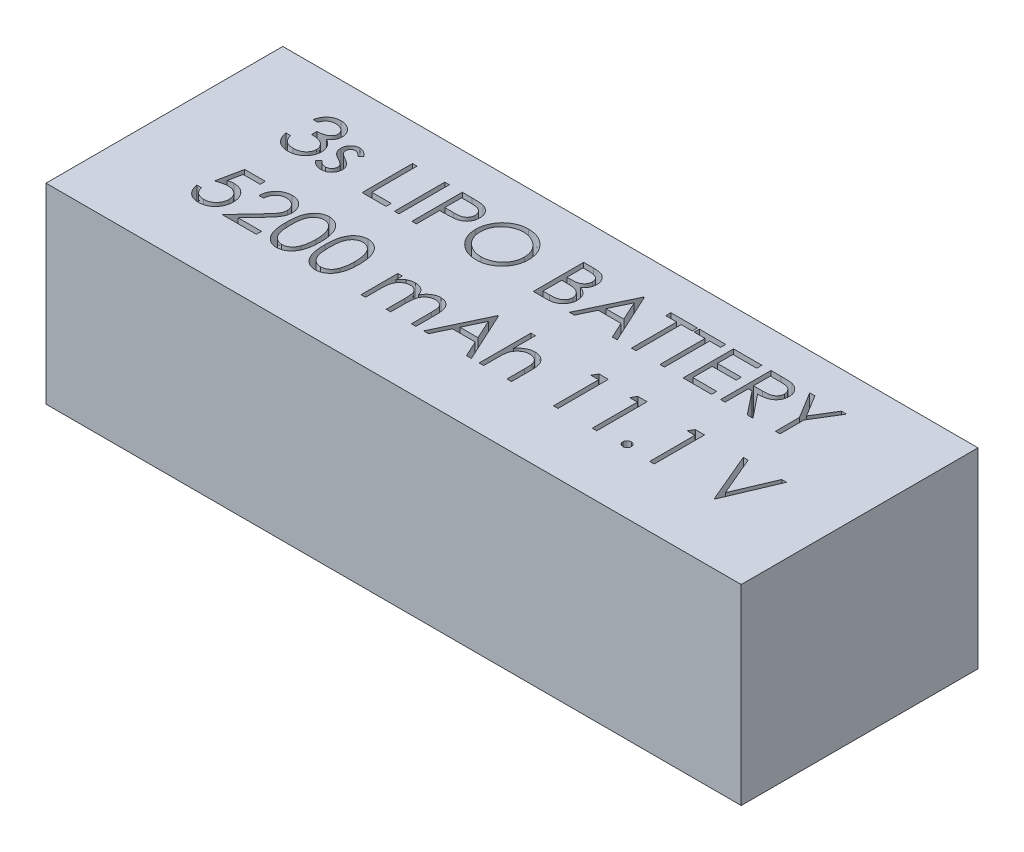
from build123d import *

# Parameters (mm, degrees)
SKETCH1_W           = 138
SKETCH1_H           = 47
BOSS_EXTRUDE1_DEPTH = 38
SKETCH2_W           = 0.897435898
SKETCH2_H           = 10
CUT_EXTRUDE1_DEPTH  = 10


with BuildPart() as part:
    # Sketch1 → Boss-Extrude1 (new body)
    with BuildSketch(Plane(origin=(0, 0, 0), x_dir=(1, 0, 0), z_dir=(0, 1, 0))):
        with Locations((69, 23.5)):
            Rectangle(SKETCH1_W, SKETCH1_H)
    extrude(amount=BOSS_EXTRUDE1_DEPTH)

    # Sketch2 → Cut-Extrude1 (cut)
    # profile 1 of 25: a face of its own
    with BuildSketch(Plane(origin=(0, 38, 0), x_dir=(1, 0, 0), z_dir=(0, 1, 0))):
        with BuildLine():
            Line((16.466681465, 37.441088259), (15.569245567, 37.441088259))
            add(Edge.make_bspline(
                [(15.569245567, 37.441088259), (15.593558569, 37.541752499), (15.641088499, 37.738542855), (15.740224423, 38.019706457), (15.848222295, 38.285773661), (15.977905451, 38.531762443), (16.119359035, 38.762616451), (16.281423953, 38.973099664), (16.456623161, 39.168565279), (16.65040873, 39.342031672), (16.853633478, 39.499110899), (17.069160963, 39.633039634), (17.292654945, 39.748251499), (17.525663896, 39.843166448), (17.768881529, 39.914667944), (18.020109025, 39.966544531), (18.280004739, 40.000233429), (18.456426427, 40.003521323), (18.546008388, 40.005190824)],
                knots=[0, 0, 0, 0, 1.162005537, 2.271625781, 3.343758855, 4.383309926, 5.390229558, 6.379919256, 7.361854164, 8.333198761, 9.295911338, 10.242430842, 11.177959212, 12.116337295, 13.062827104, 14.020064771, 14.994644689, 16, 16, 16, 16], degree=3))
            add(Edge.make_bspline(
                [(18.546008388, 40.005190824), (18.676530508, 40.001250166), (18.934727682, 39.993454807), (19.314050673, 39.922270703), (19.679841585, 39.809627468), (20.028096579, 39.653988247), (20.351577815, 39.462024495), (20.639395491, 39.233553819), (20.887648379, 38.972984386), (21.09591803, 38.685177059), (21.258989455, 38.377589889), (21.379236237, 38.061018012), (21.45244104, 37.736212379), (21.461928345, 37.516905867), (21.466681465, 37.407033772)],
                knots=[0, 0, 0, 0, 1.083050992, 2.142477498, 3.193116406, 4.255571735, 5.30263384, 6.308962982, 7.297363603, 8.282367274, 9.249857812, 10.179914175, 11.08814088, 12, 12, 12, 12], degree=3))
            add(Edge.make_bspline(
                [(21.466681465, 37.407033772), (21.463356919, 37.301300073), (21.456851298, 37.094395632), (21.40161214, 36.792334211), (21.308651389, 36.507643925), (21.179880638, 36.239126319), (21.013190495, 35.988483919), (20.811268504, 35.755152803), (20.57268947, 35.538098065), (20.391892504, 35.413756714), (20.298812875, 35.349742106)],
                knots=[0, 0, 0, 0, 1.024540389, 2.004866551, 2.965041327, 3.920577974, 4.882998113, 5.874504559, 6.905732034, 8, 8, 8, 8], degree=3))
            add(Edge.make_bspline(
                [(20.298812875, 35.349742106), (20.405189316, 35.298375901), (20.615951814, 35.196604594), (20.903239042, 34.997016715), (21.164032971, 34.766570008), (21.309472168, 34.586733857), (21.382546849, 34.496376721)],
                knots=[0, 0, 0, 0, 1.015518401, 2.012035669, 3.001164323, 4, 4, 4, 4], degree=3))
            add(Edge.make_bspline(
                [(21.382546849, 34.496376721), (21.43066497, 34.430497431), (21.526113245, 34.299817669), (21.643929055, 34.089713595), (21.750812239, 33.877280769), (21.83409858, 33.656825323), (21.898595342, 33.430902427), (21.944698292, 33.199124152), (21.973338694, 32.961301231), (21.977440271, 32.80040843), (21.979501977, 32.719533772)],
                knots=[0, 0, 0, 0, 1.025084078, 2.033381695, 3.024893161, 4.013698104, 4.991890475, 5.976764909, 6.982997093, 8, 8, 8, 8], degree=3))
            add(Edge.make_bspline(
                [(21.979501977, 32.719533772), (21.974374796, 32.579505997), (21.964144562, 32.300109421), (21.872704349, 31.887324502), (21.730952233, 31.483823067), (21.529646702, 31.097894955), (21.284310962, 30.736808152), (20.992432893, 30.413732983), (20.657328869, 30.136022685), (20.283598444, 29.903993462), (19.878692362, 29.718513684), (19.445619242, 29.589778133), (18.990619088, 29.50593242), (18.678598238, 29.496941366), (18.519966721, 29.492370311)],
                knots=[0, 0, 0, 0, 0.955779014, 1.907060117, 2.875433937, 3.871313158, 4.872415639, 5.851225146, 6.836215519, 7.83643374, 8.849228613, 9.86973379, 10.916971861, 12, 12, 12, 12], degree=3))
            add(Edge.make_bspline(
                [(18.519966721, 29.492370311), (18.413054434, 29.49485092), (18.202686706, 29.499731932), (17.893419567, 29.533099364), (17.598214712, 29.594042236), (17.316673004, 29.67605168), (17.048544329, 29.780028086), (16.794646885, 29.90951008), (16.553418618, 30.061828658), (16.3271359, 30.238781766), (16.115825707, 30.436728451), (15.925103638, 30.659182765), (15.751789944, 30.90203249), (15.600525262, 31.168098365), (15.464419683, 31.453941957), (15.352474092, 31.763223381), (15.253943896, 32.09317773), (15.208133998, 32.32311413), (15.184630182, 32.441088259)],
                knots=[0, 0, 0, 0, 1.048658725, 2.063410685, 3.046034179, 4.001477787, 4.936774919, 5.862367409, 6.792675028, 7.730719943, 8.675894397, 9.627829632, 10.600096036, 11.597688215, 12.626045268, 13.701542398, 14.82072376, 16, 16, 16, 16], degree=3))
            Line((15.184630182, 32.441088259), (16.08206608, 32.441088259))
            add(Edge.make_bspline(
                [(16.08206608, 32.441088259), (16.105446913, 32.364091079), (16.150924663, 32.214324874), (16.228336943, 31.998781144), (16.316532006, 31.801186706), (16.411145031, 31.620092072), (16.51051202, 31.453713779), (16.62169752, 31.306451296), (16.736466506, 31.171836432), (16.822978944, 31.095994684), (16.865319285, 31.058876721)],
                knots=[0, 0, 0, 0, 1.198163088, 2.33053128, 3.407730985, 4.417276592, 5.372219308, 6.28897303, 7.162600585, 8, 8, 8, 8], degree=3))
            add(Edge.make_bspline(
                [(16.865319285, 31.058876721), (16.921309504, 31.015710053), (17.033117112, 30.929509962), (17.215312058, 30.819505309), (17.406926018, 30.724188094), (17.612110802, 30.651377535), (17.826438717, 30.589727075), (18.053374046, 30.549382735), (18.290914667, 30.521702245), (18.453108277, 30.519259584), (18.535992362, 30.518011336)],
                knots=[0, 0, 0, 0, 0.946170439, 1.889420265, 2.845303464, 3.807233317, 4.801018734, 5.828864929, 6.890507805, 8, 8, 8, 8], degree=3))
            add(Edge.make_bspline(
                [(18.535992362, 30.518011336), (18.629573798, 30.519771066), (18.812564218, 30.523212064), (19.079578102, 30.554856941), (19.33359938, 30.600943837), (19.57180774, 30.672123788), (19.797323475, 30.760069077), (20.006985331, 30.870493093), (20.203545635, 31.00004944), (20.384486793, 31.147304179), (20.547188243, 31.308508451), (20.690443995, 31.477117226), (20.812228742, 31.652419596), (20.910467537, 31.835385655), (20.988040538, 32.025257738), (21.040849682, 32.222568679), (21.077568297, 32.425703725), (21.080558617, 32.563786494), (21.08206608, 32.633395952)],
                knots=[0, 0, 0, 0, 1.217147791, 2.380027433, 3.494444702, 4.572153297, 5.609568379, 6.639424714, 7.649109417, 8.668170816, 9.669597737, 10.625200337, 11.543417969, 12.441394052, 13.322311151, 14.205496177, 15.095365482, 16, 16, 16, 16], degree=3))
            add(Edge.make_bspline(
                [(21.08206608, 32.633395952), (21.07769379, 32.726571206), (21.068970966, 32.912458086), (21.002375024, 33.18593687), (20.892835412, 33.449432334), (20.73948538, 33.698448877), (20.55281187, 33.929237167), (20.334626421, 34.135155689), (20.083117198, 34.305070235), (19.851631857, 34.422466396), (19.646588553, 34.502572325), (19.471116026, 34.555929366), (19.274668588, 34.601111239), (19.059621877, 34.643146301), (18.824355544, 34.678921581), (18.569125721, 34.708755341), (18.293880688, 34.732626886), (18.1033345, 34.743287158), (18.005143003, 34.748780567)],
                knots=[0, 0, 0, 0, 1.07054697, 2.135767047, 3.216561865, 4.33974944, 5.486079747, 6.621378074, 7.775625952, 8.963672916, 9.598146892, 10.304877434, 11.070270905, 11.915000392, 12.823868403, 13.805723172, 14.86925407, 16, 16, 16, 16], degree=3))
            Line((18.005143003, 34.748780567), (18.005143003, 35.774421593))
            add(Edge.make_bspline(
                [(18.005143003, 35.774421593), (18.128860619, 35.776521032), (18.371193038, 35.780633318), (18.725176766, 35.83037049), (19.063671944, 35.899172285), (19.379176921, 36.004558548), (19.666744673, 36.126959396), (19.91622925, 36.269394281), (20.124135386, 36.427722136), (20.289452733, 36.604386734), (20.413821957, 36.793858298), (20.504755664, 36.991334463), (20.558470882, 37.198546066), (20.565641359, 37.339959403), (20.569245567, 37.411040183)],
                knots=[0, 0, 0, 0, 1.321986639, 2.589447074, 3.816329219, 5.01088745, 6.139805852, 7.153945165, 8.075214402, 8.924034688, 9.728124013, 10.488707548, 11.240355623, 12, 12, 12, 12], degree=3))
            add(Edge.make_bspline(
                [(20.569245567, 37.411040183), (20.568061536, 37.463262312), (20.565705962, 37.56715576), (20.535999454, 37.718941671), (20.491359337, 37.866087231), (20.429988681, 38.007966689), (20.347845257, 38.143596043), (20.249542438, 38.274131611), (20.132490723, 38.398828122), (19.998360874, 38.515057607), (19.854327146, 38.625826856), (19.696470646, 38.719865819), (19.529551004, 38.800280282), (19.353383418, 38.866593145), (19.167396189, 38.916476826), (18.972463167, 38.952293515), (18.768212643, 38.974686814), (18.628864837, 38.97791086), (18.558027618, 38.979549798)],
                knots=[0, 0, 0, 0, 0.884392785, 1.759457502, 2.611959086, 3.489218968, 4.37281399, 5.2945488, 6.255912374, 7.266815255, 8.301784654, 9.332968512, 10.37626691, 11.440494194, 12.520033166, 13.637162961, 14.798855837, 16, 16, 16, 16], degree=3))
            add(Edge.make_bspline(
                [(18.558027618, 38.979549798), (18.44416571, 38.975574478), (18.22176692, 38.967809753), (17.901152872, 38.899801143), (17.603097632, 38.791292334), (17.37527287, 38.661769421), (17.207036944, 38.533911038), (17.086817121, 38.422247077), (16.968758519, 38.298153295), (16.860628014, 38.153986509), (16.751273795, 37.999509966), (16.651717905, 37.826870875), (16.554975927, 37.640572606), (16.496682928, 37.508870793), (16.466681465, 37.441088259)],
                knots=[0, 0, 0, 0, 1.472543308, 2.876219568, 4.221790263, 5.565193594, 6.249813518, 6.953379497, 7.687249741, 8.463570142, 9.283606569, 10.136032583, 11.040678096, 12, 12, 12, 12], degree=3))
        make_face()
    # profile 2 of 25: a face of its own
    with BuildSketch(Plane(origin=(0, 38, 0), x_dir=(1, 0, 0), z_dir=(0, 1, 0))):
        with BuildLine():
            Line((26.979501977, 36.145014542), (26.370527618, 35.518011336))
            add(Edge.make_bspline(
                [(26.370527618, 35.518011336), (26.317983323, 35.57890604), (26.216684106, 35.69630386), (26.056022732, 35.853266908), (25.895955293, 35.985086733), (25.738672968, 36.096378901), (25.580220771, 36.18051932), (25.422458148, 36.241933212), (25.265221752, 36.279938371), (25.160118794, 36.284836767), (25.108508388, 36.287242106)],
                knots=[0, 0, 0, 0, 1.26578478, 2.440284043, 3.530471711, 4.527705817, 5.468200915, 6.346673037, 7.188140097, 8, 8, 8, 8], degree=3))
            add(Edge.make_bspline(
                [(25.108508388, 36.287242106), (25.045252988, 36.28417104), (24.920775314, 36.278127617), (24.742415833, 36.217803531), (24.576842619, 36.125207135), (24.433536962, 35.993868325), (24.31214359, 35.843113271), (24.223533073, 35.674552343), (24.169344548, 35.493272218), (24.162473885, 35.367472625), (24.158989157, 35.303668388)],
                knots=[0, 0, 0, 0, 0.99966794, 1.967205029, 2.953328237, 3.988086729, 5.028030931, 6.008226631, 6.989793394, 8, 8, 8, 8], degree=3))
            add(Edge.make_bspline(
                [(24.158989157, 35.303668388), (24.162162906, 35.24591969), (24.168501458, 35.130585088), (24.217777684, 34.960447848), (24.296252176, 34.794570596), (24.369595589, 34.692962292), (24.407386593, 34.64060749)],
                knots=[0, 0, 0, 0, 0.960159726, 1.917612774, 2.927026955, 4, 4, 4, 4], degree=3))
            add(Edge.make_bspline(
                [(24.407386593, 34.64060749), (24.430139432, 34.612651535), (24.478565983, 34.553150808), (24.569447454, 34.470568369), (24.672368891, 34.379304795), (24.796140142, 34.28805669), (24.935428793, 34.191966046), (25.093255319, 34.094817095), (25.264611048, 33.989204452), (25.387289067, 33.922220351), (25.451056465, 33.887402362)],
                knots=[0, 0, 0, 0, 0.66740084, 1.420478572, 2.27185888, 3.217733974, 4.268547843, 5.408967954, 6.65319498, 8, 8, 8, 8], degree=3))
            add(Edge.make_bspline(
                [(25.451056465, 33.887402362), (25.528809542, 33.843845497), (25.679002885, 33.759707976), (25.892410791, 33.629108823), (26.086088051, 33.499304753), (26.261675673, 33.371683971), (26.415795127, 33.242675778), (26.55312242, 33.117225044), (26.67023226, 32.991541306), (26.735814908, 32.903732409), (26.767162234, 32.861761336)],
                knots=[0, 0, 0, 0, 1.27191281, 2.456916733, 3.569705269, 4.599008579, 5.553216877, 6.436649441, 7.252746552, 8, 8, 8, 8], degree=3))
            add(Edge.make_bspline(
                [(26.767162234, 32.861761336), (26.819192312, 32.777001085), (26.922741825, 32.608312453), (27.031479729, 32.330545518), (27.094509085, 32.035944082), (27.103258286, 31.834423453), (27.107707106, 31.731953644)],
                knots=[0, 0, 0, 0, 0.995354457, 1.980940102, 2.973342416, 4, 4, 4, 4], degree=3))
            add(Edge.make_bspline(
                [(27.107707106, 31.731953644), (27.105651295, 31.659756083), (27.101600095, 31.517482903), (27.073434189, 31.307954818), (27.0249914, 31.107570368), (26.959009246, 30.914155269), (26.869911037, 30.731415441), (26.76548876, 30.554740444), (26.640131869, 30.387952071), (26.497013653, 30.231269327), (26.340312242, 30.088167192), (26.173151846, 29.962384466), (25.995326616, 29.85788636), (25.808107183, 29.771413945), (25.611068172, 29.702647494), (25.404178774, 29.655040262), (25.188096618, 29.626546659), (25.041154309, 29.622591012), (24.966280824, 29.620575439)],
                knots=[0, 0, 0, 0, 1.032770009, 2.035186124, 3.017557409, 3.978232242, 4.952395191, 5.920591857, 6.910227898, 7.931268572, 8.952309245, 9.941945286, 10.918353717, 11.897095711, 12.887975737, 13.898235213, 14.929059601, 16, 16, 16, 16], degree=3))
            add(Edge.make_bspline(
                [(24.966280824, 29.620575439), (24.865231751, 29.623411726), (24.664537674, 29.629044889), (24.367709905, 29.681919349), (24.077650594, 29.764191904), (23.796554765, 29.877666001), (23.530708725, 30.020953752), (23.287477512, 30.192560591), (23.066016191, 30.386817726), (22.93996398, 30.535711757), (22.876937875, 30.610158772)],
                knots=[0, 0, 0, 0, 1.013940152, 2.01379169, 3.017749504, 4.037548394, 5.051665909, 6.043208538, 7.021604269, 8, 8, 8, 8], degree=3))
            Line((22.876937875, 30.610158772), (23.471889798, 31.287242106))
            add(Edge.make_bspline(
                [(23.471889798, 31.287242106), (23.528382406, 31.226228493), (23.63790187, 31.107944379), (23.813048204, 30.950446262), (23.991275064, 30.818442631), (24.17080274, 30.708032874), (24.354288724, 30.622960294), (24.540704764, 30.563192882), (24.72967169, 30.524780905), (24.856592078, 30.520271527), (24.920207106, 30.518011336)],
                knots=[0, 0, 0, 0, 1.179806542, 2.287233372, 3.337373186, 4.324005949, 5.273901747, 6.200048787, 7.097828587, 8, 8, 8, 8], degree=3))
            add(Edge.make_bspline(
                [(24.920207106, 30.518011336), (25.006829751, 30.521927979), (25.17607587, 30.529580441), (25.418486609, 30.599057847), (25.642311256, 30.708000567), (25.836663672, 30.862528276), (26.002098418, 31.04240134), (26.121893202, 31.24501311), (26.196967989, 31.464417272), (26.205785128, 31.616509565), (26.210271208, 31.693892747)],
                knots=[0, 0, 0, 0, 1.072336372, 2.095165389, 3.102688358, 4.141489647, 5.156069229, 6.117746104, 7.042326257, 8, 8, 8, 8], degree=3))
            add(Edge.make_bspline(
                [(26.210271208, 31.693892747), (26.20716751, 31.757634514), (26.201039674, 31.883484102), (26.152916039, 32.065627933), (26.076879319, 32.238397307), (26.002008895, 32.339510585), (25.963876977, 32.391008131)],
                knots=[0, 0, 0, 0, 1.013901739, 2.00181326, 2.98231254, 4, 4, 4, 4], degree=3))
            add(Edge.make_bspline(
                [(25.963876977, 32.391008131), (25.94095585, 32.416823452), (25.891025358, 32.473058543), (25.799438954, 32.554273054), (25.689776491, 32.64181048), (25.560804597, 32.734186449), (25.412263277, 32.830182464), (25.24355049, 32.929294899), (25.056977483, 33.036231258), (24.925061393, 33.107144559), (24.856104541, 33.144213259)],
                knots=[0, 0, 0, 0, 0.615000592, 1.339693406, 2.178160186, 3.116406724, 4.166410947, 5.330106347, 6.604359322, 8, 8, 8, 8], degree=3))
            add(Edge.make_bspline(
                [(24.856104541, 33.144213259), (24.78168557, 33.185753636), (24.637363434, 33.266313682), (24.432942603, 33.391788197), (24.248521591, 33.519408982), (24.079662806, 33.642017094), (23.930631362, 33.766076934), (23.802014367, 33.891726224), (23.688748036, 34.013897613), (23.626041145, 34.100461317), (23.596088516, 34.141809413)],
                knots=[0, 0, 0, 0, 1.262093308, 2.447601706, 3.550203992, 4.582594899, 5.537233252, 6.418365656, 7.244515135, 8, 8, 8, 8], degree=3))
            add(Edge.make_bspline(
                [(23.596088516, 34.141809413), (23.544286803, 34.225082599), (23.440665273, 34.391658071), (23.340050441, 34.669688005), (23.270890359, 34.962388169), (23.264712101, 35.16435061), (23.261553259, 35.267610695)],
                knots=[0, 0, 0, 0, 0.985009483, 1.970363186, 2.962279964, 4, 4, 4, 4], degree=3))
            add(Edge.make_bspline(
                [(23.261553259, 35.267610695), (23.263079532, 35.335111832), (23.266066663, 35.467221121), (23.28990681, 35.661332036), (23.333311699, 35.845755333), (23.387754335, 36.023260656), (23.463420062, 36.190409496), (23.553836934, 36.349430842), (23.66008672, 36.500104893), (23.782496122, 36.640113842), (23.917086537, 36.767283346), (24.062500165, 36.878136568), (24.215466612, 36.972726153), (24.376633525, 37.052055184), (24.547549162, 37.112059134), (24.727018838, 37.153365948), (24.91467928, 37.180952242), (25.042968212, 37.183418197), (25.108508388, 37.184678003)],
                knots=[0, 0, 0, 0, 1.087655834, 2.128696564, 3.144119009, 4.137814668, 5.115653402, 6.093965665, 7.082169637, 8.081268856, 9.086088321, 10.061021666, 11.022561449, 11.980240094, 12.950172527, 13.934149372, 14.944599409, 16, 16, 16, 16], degree=3))
            add(Edge.make_bspline(
                [(25.108508388, 37.184678003), (25.186199998, 37.181522744), (25.343040631, 37.175153036), (25.578339563, 37.124565349), (25.813291969, 37.041327909), (26.04850154, 36.926367242), (26.282245224, 36.777604739), (26.5165791, 36.597806741), (26.75431633, 36.388156128), (26.902762939, 36.227872627), (26.979501977, 36.145014542)],
                knots=[0, 0, 0, 0, 0.845714091, 1.707292901, 2.609013841, 3.555613372, 4.552488639, 5.621697636, 6.770543573, 8, 8, 8, 8], degree=3))
        make_face()
    # profile 3 of 25: a face of its own
    with BuildSketch(Plane(origin=(0, 38, 0), x_dir=(1, 0, 0), z_dir=(0, 1, 0))):
        Polygon((33.005143003, 39.748780567), (33.9025789, 39.748780567), (33.9025789, 30.774421593), (37.748732747, 30.774421593), (37.748732747, 29.748780567), (33.005143003, 29.748780567), align=None)
    # profile 4 of 25: a face of its own
    with BuildSketch(Plane(origin=(0, 38, 0), x_dir=(1, 0, 0), z_dir=(0, 1, 0))):
        with Locations((39.864117362, 34.748780567)):
            Rectangle(SKETCH2_W, SKETCH2_H)
    # profile 5 of 25: a face of its own
    with BuildSketch(Plane(origin=(0, 38, 0), x_dir=(1, 0, 0), z_dir=(0, 1, 0))):
        with BuildLine():
            Line((42.876937875, 39.748780567), (44.838075695, 39.748780567))
            add(Edge.make_bspline(
                [(44.838075695, 39.748780567), (44.972963999, 39.748632292), (45.231415978, 39.748348191), (45.602030423, 39.739734631), (45.938629656, 39.728229797), (46.240487887, 39.71228153), (46.508533882, 39.69343413), (46.741554738, 39.666999732), (46.941382042, 39.639398887), (47.061114754, 39.611337726), (47.115719926, 39.598540183)],
                knots=[0, 0, 0, 0, 1.415646017, 2.712440637, 3.8905458, 4.950247383, 5.884950622, 6.709939814, 7.411656543, 8, 8, 8, 8], degree=3))
            add(Edge.make_bspline(
                [(47.115719926, 39.598540183), (47.184844308, 39.579620326), (47.321464243, 39.542226435), (47.518324366, 39.467330083), (47.705621068, 39.378523896), (47.883996949, 39.27731264), (48.051260043, 39.159353885), (48.209905875, 39.029429263), (48.35853439, 38.884539067), (48.496309795, 38.726308381), (48.622837788, 38.557393496), (48.731779739, 38.375272839), (48.823000388, 38.183011972), (48.901238306, 37.980744626), (48.957548176, 37.766772273), (48.99996789, 37.542581667), (49.02689254, 37.308196837), (49.029471288, 37.148025787), (49.030784029, 37.0664889)],
                knots=[0, 0, 0, 0, 0.999701418, 1.975846123, 2.934577507, 3.890451536, 4.834027766, 5.787354733, 6.749476667, 7.726910423, 8.712836071, 9.690891519, 10.682875813, 11.679750201, 12.712814741, 13.765529915, 14.8625177, 16, 16, 16, 16], degree=3))
            add(Edge.make_bspline(
                [(49.030784029, 37.0664889), (49.029579958, 36.984266681), (49.027224112, 36.823393356), (48.998949011, 36.588042532), (48.96086275, 36.363132846), (48.902299743, 36.149162988), (48.82559782, 35.947403643), (48.735620526, 35.754771552), (48.627096154, 35.574543918), (48.50239664, 35.406066439), (48.363677799, 35.249180975), (48.211526547, 35.10502442), (48.04655714, 34.974440596), (47.86929386, 34.857136757), (47.678008577, 34.755833101), (47.475602424, 34.665097944), (47.260316092, 34.588894914), (47.11133748, 34.548809024), (47.035591721, 34.528428003)],
                knots=[0, 0, 0, 0, 1.121902311, 2.195077645, 3.232258892, 4.234102512, 5.217864754, 6.176164875, 7.132989551, 8.084763148, 9.034132444, 9.988522005, 10.94243251, 11.903244335, 12.886203696, 13.894208494, 14.929344452, 16, 16, 16, 16], degree=3))
            add(Edge.make_bspline(
                [(47.035591721, 34.528428003), (46.972942195, 34.5151052), (46.835642117, 34.485907502), (46.609520054, 34.453311911), (46.346247522, 34.425490195), (46.046183866, 34.404629802), (45.709598423, 34.386771606), (45.336309116, 34.372577053), (44.925583182, 34.36477747), (44.639093913, 34.364375205), (44.489518003, 34.364165183)],
                knots=[0, 0, 0, 0, 0.601384939, 1.31797006, 2.144135048, 3.087295005, 4.142315834, 5.309527816, 6.595305764, 8, 8, 8, 8], degree=3))
            Line((44.489518003, 34.364165183), (43.774373772, 34.364165183))
            Line((43.774373772, 34.364165183), (43.774373772, 29.748780567))
            Line((43.774373772, 29.748780567), (42.876937875, 29.748780567))
            Line((42.876937875, 29.748780567), (42.876937875, 39.748780567))
        make_face()
        with BuildLine():
            Line((43.774373772, 38.723139542), (43.774373772, 35.389806208))
            Line((43.774373772, 35.389806208), (45.525175054, 35.367770952))
            add(Edge.make_bspline(
                [(45.525175054, 35.367770952), (45.610660557, 35.36772677), (45.775688556, 35.367641478), (46.014077766, 35.379027831), (46.235247158, 35.39217221), (46.438517373, 35.411417706), (46.623980043, 35.438621298), (46.791944411, 35.466083407), (46.941108077, 35.505813014), (47.115677225, 35.559307498), (47.310201075, 35.650543542), (47.521822642, 35.7829718), (47.701167174, 35.951773823), (47.856362308, 36.141567627), (47.979521959, 36.352707997), (48.069681937, 36.578619244), (48.122656673, 36.816984529), (48.129760083, 36.980093497), (48.133348131, 37.06248249)],
                knots=[0, 0, 0, 0, 1.160613943, 2.240541288, 3.23993089, 4.169200891, 5.011653406, 5.7853311, 6.478053781, 7.106038997, 8.262395093, 9.384106736, 10.481365981, 11.59014053, 12.70357646, 13.786202915, 14.881775077, 16, 16, 16, 16], degree=3))
            add(Edge.make_bspline(
                [(48.133348131, 37.06248249), (48.12974057, 37.142878243), (48.122569184, 37.302695049), (48.069266718, 37.536920079), (47.97969725, 37.760450663), (47.855535551, 37.968945193), (47.704846608, 38.158056061), (47.529705628, 38.322333567), (47.330524882, 38.454395575), (47.145244221, 38.539633523), (46.980669404, 38.591677167), (46.837720947, 38.628090997), (46.67631902, 38.657164157), (46.496411079, 38.680705594), (46.299391553, 38.70085834), (46.083567797, 38.714532561), (45.849757387, 38.722536722), (45.687441471, 38.722933737), (45.603300054, 38.723139542)],
                knots=[0, 0, 0, 0, 1.120700087, 2.227813068, 3.331159281, 4.466773991, 5.599788987, 6.693661531, 7.80175334, 8.91857717, 9.525282508, 10.207424825, 10.974604443, 11.810962634, 12.737642355, 13.736264703, 14.826523623, 16, 16, 16, 16], degree=3))
            Line((45.603300054, 38.723139542), (43.774373772, 38.723139542))
        make_face(mode=Mode.SUBTRACT)
    # profile 6 of 25: a face of its own
    with BuildSketch(Plane(origin=(0, 38, 0), x_dir=(1, 0, 0), z_dir=(0, 1, 0))):
        with BuildLine():
            add(Edge.make_bspline(
                [(55.761553259, 40.005190824), (55.946719276, 40.000500883), (56.31040061, 39.991289451), (56.844900318, 39.920777727), (57.355172019, 39.798790898), (57.845372416, 39.636325234), (58.309638063, 39.419598419), (58.75146347, 39.157640852), (59.169797395, 38.847708113), (59.559001343, 38.492196036), (59.915164058, 38.105386168), (60.228952304, 37.692592139), (60.491930286, 37.256309847), (60.707889678, 36.797850331), (60.877314277, 36.318250422), (60.994225831, 35.814953271), (61.06890626, 35.291219871), (61.077637052, 34.934000258), (61.08206608, 34.752786977)],
                knots=[0, 0, 0, 0, 1.065120563, 2.091984664, 3.0946048, 4.079830382, 5.057816894, 6.036188127, 7.030412546, 8.04752943, 9.064399622, 10.05169764, 11.02544977, 11.989514704, 12.962713494, 13.945757189, 14.957906945, 16, 16, 16, 16], degree=3))
            add(Edge.make_bspline(
                [(61.08206608, 34.752786977), (61.077637701, 34.572908559), (61.068908854, 34.218347358), (60.994140918, 33.697937518), (60.876880918, 33.197678385), (60.709463015, 32.718405091), (60.494533076, 32.259612052), (60.229804016, 31.822506469), (59.917971985, 31.406945045), (59.563095268, 31.017480287), (59.176235148, 30.660344657), (58.761291529, 30.349147869), (58.327596329, 30.081364656), (57.869568591, 29.867697016), (57.393282772, 29.696920101), (56.894476134, 29.580484015), (56.37548598, 29.505378177), (56.021568826, 29.496753846), (55.841681465, 29.492370311)],
                knots=[0, 0, 0, 0, 1.043624062, 2.057103931, 3.04512605, 4.022047818, 4.998200453, 5.980619268, 6.982898556, 8.009068085, 9.034988726, 10.034168286, 11.015286542, 11.987931943, 12.962482838, 13.94673481, 14.956375938, 16, 16, 16, 16], degree=3))
            add(Edge.make_bspline(
                [(55.841681465, 29.492370311), (55.660469125, 29.49679713), (55.303251365, 29.50552357), (54.778859835, 29.580327584), (54.275209138, 29.697302738), (53.793739564, 29.864472555), (53.334182622, 30.080521786), (52.895639528, 30.343962869), (52.479870536, 30.656554701), (52.090322689, 31.011316343), (51.733896409, 31.397520777), (51.423155335, 31.811332934), (51.159655011, 32.244634239), (50.944331204, 32.698627165), (50.773861321, 33.171117001), (50.65756184, 33.665255508), (50.582316263, 34.178225525), (50.573645273, 34.527490949), (50.569245567, 34.704710054)],
                knots=[0, 0, 0, 0, 1.053102029, 2.075944431, 3.073151272, 4.055350789, 5.033113405, 6.020478099, 7.024410459, 8.052272461, 9.079885166, 10.07527673, 11.055994387, 12.023226415, 12.992069828, 13.970394897, 14.97016774, 16, 16, 16, 16], degree=3))
            add(Edge.make_bspline(
                [(50.569245567, 34.704710054), (50.570773097, 34.823660538), (50.573808887, 35.06006089), (50.610356579, 35.411108319), (50.663390011, 35.756510199), (50.739395476, 36.095284336), (50.838800239, 36.426601435), (50.956091746, 36.752746472), (51.099348447, 37.070414254), (51.261293155, 37.381109659), (51.442041178, 37.67998939), (51.641686177, 37.962502484), (51.853215801, 38.231019618), (52.085111211, 38.478582486), (52.329729626, 38.712392933), (52.591039278, 38.928857839), (52.86744569, 39.129929127), (53.160138204, 39.311130102), (53.461904704, 39.475013343), (53.772981212, 39.615647203), (54.089142844, 39.736350236), (54.41187041, 39.834181165), (54.740306902, 39.911415554), (55.075169143, 39.964007993), (55.416190361, 40.000648901), (55.645936987, 40.003670336), (55.761553259, 40.005190824)],
                knots=[0, 0, 0, 0, 1.037015668, 2.060948919, 3.074880161, 4.083647147, 5.086022904, 6.090072063, 7.104153813, 8.122640571, 9.144368836, 10.147691507, 11.138137339, 12.123020368, 13.103399296, 14.087645067, 15.080126199, 16.082011238, 17.087798457, 18.072939717, 19.057185487, 20.037253025, 21.01195951, 21.997135196, 22.992090687, 24, 24, 24, 24], degree=3))
        make_face()
        with BuildLine():
            add(Edge.make_bspline(
                [(55.805623772, 38.979549798), (55.710724819, 38.978392969), (55.521834154, 38.976090369), (55.241021193, 38.945759753), (54.963901382, 38.902531499), (54.69041749, 38.840870011), (54.421713806, 38.756858432), (54.155285689, 38.660170123), (53.893562678, 38.542395578), (53.637408798, 38.409330709), (53.389080012, 38.262048078), (53.154758008, 38.099271601), (52.933836168, 37.924818588), (52.726855406, 37.73828191), (52.534423485, 37.538711619), (52.35275291, 37.329133231), (52.189125534, 37.103556399), (52.039166743, 36.868098094), (51.904972913, 36.623065004), (51.785643328, 36.371036827), (51.688031875, 36.109957721), (51.608425085, 35.842660128), (51.542425626, 35.569567387), (51.500614414, 35.288607818), (51.46995053, 35.001193213), (51.467779543, 34.806959344), (51.466681465, 34.708716465)],
                knots=[0, 0, 0, 0, 1.008559885, 2.007477868, 2.99961109, 3.989939068, 4.984837346, 5.991145699, 7.001802488, 8.033829008, 9.059044045, 10.069351652, 11.065060232, 12.050310815, 13.029377138, 14.011219647, 14.996725999, 15.989392538, 16.977580475, 17.965360261, 18.951710183, 19.937753436, 20.929683414, 21.935841486, 22.955955122, 24, 24, 24, 24], degree=3))
            add(Edge.make_bspline(
                [(51.466681465, 34.708716465), (51.470323927, 34.564252977), (51.477489778, 34.280048604), (51.540225693, 33.863568193), (51.636859906, 33.463315947), (51.779309524, 33.08148192), (51.957454137, 32.714783969), (52.177530967, 32.366475099), (52.438271211, 32.036461172), (52.734452716, 31.727046118), (53.058231877, 31.444629534), (53.402039677, 31.196734081), (53.762192842, 30.98699051), (54.139630564, 30.816118875), (54.532337818, 30.680719624), (54.942845107, 30.587923535), (55.368417848, 30.526850805), (55.658505434, 30.520985788), (55.805623772, 30.518011336)],
                knots=[0, 0, 0, 0, 1.032063989, 2.030389145, 3.003944642, 3.970395727, 4.937377036, 5.913328081, 6.909231446, 7.93887556, 8.970685674, 9.976071282, 10.964166581, 11.944589148, 12.933237628, 13.927779006, 14.949070134, 16, 16, 16, 16], degree=3))
            add(Edge.make_bspline(
                [(55.805623772, 30.518011336), (55.904508063, 30.51936992), (56.100625309, 30.5220644), (56.392326802, 30.549203477), (56.678773121, 30.592723104), (56.959562492, 30.65538212), (57.234376239, 30.73380271), (57.504361391, 30.826967647), (57.76664222, 30.943199657), (58.024527471, 31.071622376), (58.271373876, 31.218022826), (58.507018254, 31.375274682), (58.725521053, 31.549470741), (58.932346972, 31.73323592), (59.12556894, 31.930275485), (59.303880324, 32.140333262), (59.466680701, 32.36473514), (59.616582549, 32.599836299), (59.750306157, 32.845539878), (59.866817868, 33.098481815), (59.965663914, 33.358039271), (60.045459642, 33.624586618), (60.107989532, 33.897617614), (60.151075018, 34.177497837), (60.181213414, 34.463667387), (60.183485063, 34.657221262), (60.184630182, 34.754790183)],
                knots=[0, 0, 0, 0, 1.047197238, 2.076906641, 3.100256066, 4.114471768, 5.12198147, 6.126382909, 7.136867548, 8.15857795, 9.17633901, 10.174870724, 11.156907918, 12.133735059, 13.104061851, 14.077631395, 15.04955518, 16.038496417, 17.029181396, 18.010275684, 18.986308667, 19.968651475, 20.955262928, 21.950658345, 22.966943676, 24, 24, 24, 24], degree=3))
            add(Edge.make_bspline(
                [(60.184630182, 34.754790183), (60.183484145, 34.851691623), (60.18121077, 35.043913481), (60.151089414, 35.328087248), (60.107944013, 35.605953566), (60.045764847, 35.876421575), (59.96562155, 36.139560218), (59.866800606, 36.395122354), (59.750271179, 36.644060054), (59.616533395, 36.885758046), (59.466202471, 37.117685869), (59.301933205, 37.339407047), (59.120889353, 37.546757737), (58.928243567, 37.744856863), (58.719183895, 37.929479404), (58.494657341, 38.100686606), (58.25738969, 38.262610247), (58.006169017, 38.408683281), (57.746900578, 38.543581089), (57.480860698, 38.659155383), (57.21106327, 38.757361439), (56.938194378, 38.841124196), (56.659957297, 38.902289996), (56.378232072, 38.94579871), (56.093408476, 38.976079813), (55.90185642, 38.978389466), (55.805623772, 38.979549798)],
                knots=[0, 0, 0, 0, 1.02996197, 2.043119294, 3.035359645, 4.018872909, 4.991431989, 5.957985074, 6.929999688, 7.912076566, 8.892894881, 9.867085534, 10.843653904, 11.817741046, 12.803660682, 13.806313499, 14.818574707, 15.856120519, 16.894564902, 17.924820532, 18.937903209, 19.946497019, 20.957711757, 21.963978472, 22.977135795, 24, 24, 24, 24], degree=3))
        make_face(mode=Mode.SUBTRACT)
    # profile 7 of 25: a face of its own
    with BuildSketch(Plane(origin=(0, 38, 0), x_dir=(1, 0, 0), z_dir=(0, 1, 0))):
        with BuildLine():
            Line((66.979501977, 39.748780567), (68.930623772, 39.748780567))
            add(Edge.make_bspline(
                [(68.930623772, 39.748780567), (69.02613371, 39.748278423), (69.211255739, 39.747305143), (69.480454145, 39.732210483), (69.732593604, 39.711628569), (69.967747239, 39.678971161), (70.185806389, 39.639566084), (70.387428209, 39.591846609), (70.571971559, 39.534627713), (70.792293663, 39.443638338), (71.043495551, 39.308429286), (71.315490959, 39.108633385), (71.5480745, 38.864254919), (71.748606835, 38.588590189), (71.908038605, 38.285345127), (72.023379454, 37.961747445), (72.096401955, 37.621971039), (72.103911767, 37.388704817), (72.107707106, 37.270815824)],
                knots=[0, 0, 0, 0, 1.001505555, 1.941167018, 2.826882275, 3.653841531, 4.429895133, 5.150066043, 5.825578002, 6.45369114, 7.647487171, 8.808567382, 9.977351308, 11.170798116, 12.373658725, 13.556498008, 14.765093433, 16, 16, 16, 16], degree=3))
            add(Edge.make_bspline(
                [(72.107707106, 37.270815824), (72.104583624, 37.16037995), (72.098445689, 36.943363044), (72.039752091, 36.625951304), (71.947864467, 36.323804964), (71.820135184, 36.03802672), (71.65412948, 35.77507354), (71.457391427, 35.532824208), (71.220029134, 35.321535474), (71.042191305, 35.203412895), (70.951857747, 35.143411977)],
                knots=[0, 0, 0, 0, 1.044552857, 2.05264487, 3.044412934, 4.028983338, 5.005914585, 5.980388656, 6.974128949, 8, 8, 8, 8], degree=3))
            add(Edge.make_bspline(
                [(70.951857747, 35.143411977), (71.065458968, 35.099797695), (71.282806247, 35.016352768), (71.581909139, 34.868822871), (71.839608696, 34.708359698), (72.057886256, 34.533125841), (72.24456527, 34.344243524), (72.407573675, 34.138943198), (72.546663315, 33.914546747), (72.665843097, 33.673393788), (72.758839543, 33.417946736), (72.828484984, 33.150601661), (72.868391981, 32.872317218), (72.874070956, 32.68293042), (72.876937875, 32.587322234)],
                knots=[0, 0, 0, 0, 1.27268992, 2.434971085, 3.483601985, 4.442670788, 5.356604649, 6.2567628, 7.179492994, 8.113709626, 9.066344395, 10.018646069, 10.999752585, 12, 12, 12, 12], degree=3))
            add(Edge.make_bspline(
                [(72.876937875, 32.587322234), (72.874146886, 32.489702599), (72.868655538, 32.297633233), (72.828141333, 32.015475706), (72.759543884, 31.745833001), (72.665054895, 31.486961051), (72.541733996, 31.239360666), (72.391654098, 31.002751341), (72.212706773, 30.779510396), (72.012527147, 30.567157187), (71.786063875, 30.376220652), (71.541733146, 30.206175776), (71.276457947, 30.066329884), (70.994595106, 29.948855537), (70.692982775, 29.859120684), (70.372975325, 29.796341902), (70.034848748, 29.754041796), (69.802820888, 29.750564068), (69.6838289, 29.748780567)],
                knots=[0, 0, 0, 0, 0.978564426, 1.925352924, 2.850884081, 3.763762016, 4.682927383, 5.618979971, 6.567305752, 7.547517671, 8.540179244, 9.531824382, 10.526200242, 11.540722885, 12.589160233, 13.674978461, 14.80764778, 16, 16, 16, 16], degree=3))
            Line((69.6838289, 29.748780567), (66.979501977, 29.748780567))
            Line((66.979501977, 29.748780567), (66.979501977, 39.748780567))
        make_face()
        with BuildLine():
            Line((67.876937875, 38.723139542), (67.876937875, 35.518011336))
            Line((67.876937875, 35.518011336), (68.479902618, 35.518011336))
            add(Edge.make_bspline(
                [(68.479902618, 35.518011336), (68.568042034, 35.519153974), (68.738345346, 35.521361781), (68.984973622, 35.527686116), (69.213902245, 35.545394811), (69.424736054, 35.563098417), (69.617143037, 35.591882953), (69.790696927, 35.626146162), (69.948121489, 35.662383033), (70.129663048, 35.724010139), (70.335585758, 35.815089211), (70.555108913, 35.956437314), (70.748635969, 36.124792609), (70.912056505, 36.3190525), (71.045803564, 36.532955888), (71.138699893, 36.763089832), (71.201692133, 37.003718781), (71.207382223, 37.168913788), (71.210271208, 37.252786977)],
                knots=[0, 0, 0, 0, 1.156816544, 2.235205308, 3.236616184, 4.169592532, 5.011045266, 5.787822928, 6.49130361, 7.128639758, 8.301311294, 9.436451833, 10.541879658, 11.654887649, 12.756523258, 13.837046038, 14.901820046, 16, 16, 16, 16], degree=3))
            add(Edge.make_bspline(
                [(71.210271208, 37.252786977), (71.208767836, 37.308289182), (71.205818808, 37.417162816), (71.181666515, 37.575875257), (71.140616302, 37.725143121), (71.08788975, 37.867012008), (71.014207782, 37.997045865), (70.92745503, 38.11974071), (70.822638772, 38.230918192), (70.703332164, 38.334831044), (70.56616467, 38.426958266), (70.411218122, 38.507646161), (70.236396188, 38.572619809), (70.044645174, 38.629523102), (69.833013495, 38.669489655), (69.603943343, 38.702785049), (69.355558431, 38.71973574), (69.183715281, 38.721979634), (69.094886593, 38.723139542)],
                knots=[0, 0, 0, 0, 0.91205012, 1.789085906, 2.630437955, 3.453916878, 4.269457761, 5.079663411, 5.91843418, 6.774407191, 7.675494373, 8.627863946, 9.638891023, 10.736472738, 11.911756761, 13.175263542, 14.539845004, 16, 16, 16, 16], degree=3))
            Line((69.094886593, 38.723139542), (67.876937875, 38.723139542))
        make_face(mode=Mode.SUBTRACT)
        with BuildLine():
            Line((67.876937875, 34.492370311), (67.876937875, 30.774421593))
            Line((67.876937875, 30.774421593), (69.154982747, 30.774421593))
            add(Edge.make_bspline(
                [(69.154982747, 30.774421593), (69.246465392, 30.775518014), (69.422786131, 30.777631221), (69.677361074, 30.784529948), (69.913312799, 30.800222165), (70.129564616, 30.824924592), (70.328451623, 30.851720161), (70.507587917, 30.887752393), (70.668425613, 30.929035137), (70.854923635, 30.992847058), (71.064933659, 31.091979832), (71.291250391, 31.24144905), (71.492468157, 31.419515644), (71.663340327, 31.62560397), (71.803377437, 31.849693475), (71.905250166, 32.087251618), (71.968081185, 32.334353125), (71.975687383, 32.502829447), (71.979501977, 32.587322234)],
                knots=[0, 0, 0, 0, 1.160039823, 2.235823828, 3.228722157, 4.157150951, 4.99529583, 5.772374946, 6.472645482, 7.099169577, 8.269452708, 9.405989375, 10.527446681, 11.663510218, 12.788923519, 13.866172445, 14.929861265, 16, 16, 16, 16], degree=3))
            add(Edge.make_bspline(
                [(71.979501977, 32.587322234), (71.978713108, 32.64016035), (71.977148093, 32.744984298), (71.953546336, 32.899029495), (71.919220994, 33.048246276), (71.874845469, 33.19303982), (71.81021842, 33.330792324), (71.734771148, 33.464228209), (71.646310001, 33.593523864), (71.508469527, 33.756987445), (71.307978143, 33.945321768), (71.023101641, 34.129714632), (70.69918079, 34.278422652), (70.464245096, 34.341564013), (70.342883388, 34.374181208)],
                knots=[0, 0, 0, 0, 0.723448775, 1.435228256, 2.130040452, 2.821711965, 3.505591119, 4.210454504, 4.921174351, 5.648778258, 7.137944449, 8.670945889, 10.280296675, 12, 12, 12, 12], degree=3))
            add(Edge.make_bspline(
                [(70.342883388, 34.374181208), (70.294228828, 34.384052877), (70.188735707, 34.40545669), (70.016714049, 34.428050128), (69.820325852, 34.448178871), (69.599117631, 34.463067893), (69.352809514, 34.478458017), (69.08087546, 34.48444322), (68.78442599, 34.491583963), (68.578733497, 34.49210149), (68.471889798, 34.492370311)],
                knots=[0, 0, 0, 0, 0.634451884, 1.375622551, 2.216452059, 3.157844607, 4.20941857, 5.370758133, 6.634282058, 8, 8, 8, 8], degree=3))
            Line((68.471889798, 34.492370311), (67.876937875, 34.492370311))
        make_face(mode=Mode.SUBTRACT)
    # profile 8 of 25: a face of its own
    with BuildSketch(Plane(origin=(0, 38, 0), x_dir=(1, 0, 0), z_dir=(0, 1, 0))):
        Polygon((79.030784029, 39.748780567), (83.646168644, 29.748780567), (82.670607747, 29.748780567), (81.192242362, 32.953908772), (76.658989157, 32.953908772), (75.138556465, 29.748780567), (74.158989157, 29.748780567), (78.9025789, 39.748780567), align=None)
        Polygon((78.956665439, 37.799661977), (77.145768003, 33.979549798), (80.719485952, 33.979549798), align=None, mode=Mode.SUBTRACT)
    # profile 9 of 25: a face of its own
    with BuildSketch(Plane(origin=(0, 38, 0), x_dir=(1, 0, 0), z_dir=(0, 1, 0))):
        Polygon((84.287194285, 38.723139542), (84.287194285, 39.748780567), (89.543604541, 39.748780567), (89.543604541, 38.723139542), (87.364117362, 38.723139542), (87.364117362, 29.748780567), (86.466681465, 29.748780567), (86.466681465, 38.723139542), align=None)
    # profile 10 of 25: a face of its own
    with BuildSketch(Plane(origin=(0, 38, 0), x_dir=(1, 0, 0), z_dir=(0, 1, 0))):
        Polygon((89.928219926, 38.723139542), (89.928219926, 39.748780567), (95.184630182, 39.748780567), (95.184630182, 38.723139542), (93.005143003, 38.723139542), (93.005143003, 29.748780567), (92.107707106, 29.748780567), (92.107707106, 38.723139542), align=None)
    # profile 11 of 25: a face of its own
    with BuildSketch(Plane(origin=(0, 38, 0), x_dir=(1, 0, 0), z_dir=(0, 1, 0))):
        Polygon((96.723091721, 39.748780567), (102.364117362, 39.748780567), (102.364117362, 38.723139542), (97.620527618, 38.723139542), (97.620527618, 35.646216465), (102.364117362, 35.646216465), (102.364117362, 34.620575439), (97.620527618, 34.620575439), (97.620527618, 30.774421593), (102.364117362, 30.774421593), (102.364117362, 29.748780567), (96.723091721, 29.748780567), align=None)
    # profile 12 of 25: a face of its own
    with BuildSketch(Plane(origin=(0, 38, 0), x_dir=(1, 0, 0), z_dir=(0, 1, 0))):
        with BuildLine():
            Line((104.158989157, 39.748780567), (106.16019108, 39.748780567))
            add(Edge.make_bspline(
                [(106.16019108, 39.748780567), (106.293737161, 39.748336036), (106.550160431, 39.747482486), (106.917512632, 39.742723164), (107.251304338, 39.729082147), (107.551361022, 39.717343337), (107.817677179, 39.695937791), (108.051069438, 39.675478799), (108.250462859, 39.648696911), (108.371165292, 39.623824274), (108.42581608, 39.612562618)],
                knots=[0, 0, 0, 0, 1.410062039, 2.707475311, 3.878576406, 4.937260626, 5.877586885, 6.699081471, 7.410979367, 8, 8, 8, 8], degree=3))
            add(Edge.make_bspline(
                [(108.42581608, 39.612562618), (108.498977863, 39.594486146), (108.64374069, 39.558718821), (108.85216945, 39.483119962), (109.050781804, 39.39563532), (109.238752731, 39.292881833), (109.415140706, 39.174096749), (109.581764451, 39.041330684), (109.739380061, 38.895310097), (109.88161329, 38.732353407), (110.015724866, 38.56139195), (110.128835228, 38.376524074), (110.226339455, 38.183205424), (110.303969504, 37.979469944), (110.366478, 37.767293453), (110.410552969, 37.544754034), (110.436984934, 37.312865534), (110.43967595, 37.15470008), (110.441040439, 37.074501721)],
                knots=[0, 0, 0, 0, 1.027469482, 2.033020251, 3.019912614, 3.986113645, 4.951240523, 5.91722682, 6.890402269, 7.87763091, 8.8651537, 9.85103654, 10.82876324, 11.815024772, 12.821070561, 13.842952187, 14.906261191, 16, 16, 16, 16], degree=3))
            add(Edge.make_bspline(
                [(110.441040439, 37.074501721), (110.436843301, 36.941258565), (110.428653599, 36.681266657), (110.35229616, 36.303949853), (110.227220389, 35.951980382), (110.054868135, 35.625801417), (109.835383919, 35.331771002), (109.571598801, 35.073512558), (109.263365626, 34.857398522), (108.976424723, 34.707533366), (108.722955581, 34.611553627), (108.514288973, 34.544021173), (108.286669037, 34.491844129), (108.042276653, 34.445100895), (107.78009478, 34.40981034), (107.50075181, 34.383962927), (107.20404852, 34.367808502), (107.000222607, 34.365402774), (106.895367362, 34.364165183)],
                knots=[0, 0, 0, 0, 1.260483769, 2.459530307, 3.627416485, 4.787058657, 5.939039949, 7.08810263, 8.267026773, 9.491475466, 10.141966685, 10.831826277, 11.566392101, 12.351337768, 13.187381173, 14.07005841, 15.007169909, 16, 16, 16, 16], degree=3))
            Line((106.895367362, 34.364165183), (110.569245567, 29.748780567))
            Line((110.569245567, 29.748780567), (109.459469926, 29.748780567))
            Line((109.459469926, 29.748780567), (105.785591721, 34.364165183))
            Line((105.785591721, 34.364165183), (105.056425054, 34.364165183))
            Line((105.056425054, 34.364165183), (105.056425054, 29.748780567))
            Line((105.056425054, 29.748780567), (104.158989157, 29.748780567))
            Line((104.158989157, 29.748780567), (104.158989157, 39.748780567))
        make_face()
        with BuildLine():
            Line((105.056425054, 38.723139542), (105.056425054, 35.389806208))
            Line((105.056425054, 35.389806208), (106.887354541, 35.375783772))
            add(Edge.make_bspline(
                [(106.887354541, 35.375783772), (106.972840367, 35.375745953), (107.138536244, 35.375672649), (107.37825243, 35.387083439), (107.601452749, 35.400064348), (107.807283469, 35.419919621), (107.995836542, 35.445508397), (108.167017722, 35.477516924), (108.321106442, 35.514808531), (108.500816552, 35.572527462), (108.701492356, 35.663973228), (108.919582241, 35.79701751), (109.105303206, 35.964357851), (109.262211384, 36.155710582), (109.388295474, 36.366099865), (109.477187058, 36.593003777), (109.533594036, 36.830694057), (109.540247023, 36.994060079), (109.543604541, 37.076504926)],
                knots=[0, 0, 0, 0, 1.146690395, 2.22261258, 3.21895312, 4.145990853, 4.996080663, 5.770904154, 6.481378293, 7.121626537, 8.300444488, 9.431385265, 10.535395872, 11.636531494, 12.74115979, 13.810798291, 14.895190096, 16, 16, 16, 16], degree=3))
            add(Edge.make_bspline(
                [(109.543604541, 37.076504926), (109.54016991, 37.156923708), (109.533363723, 37.31628439), (109.477795813, 37.549586991), (109.383826152, 37.769778277), (109.257191186, 37.97596252), (109.102907887, 38.163121765), (108.92199985, 38.323256488), (108.719413578, 38.455397816), (108.530067297, 38.539838903), (108.36082669, 38.591609912), (108.213884804, 38.628041809), (108.047852011, 38.65731172), (107.861922129, 38.680763323), (107.656888898, 38.700920306), (107.43171561, 38.714496817), (107.187896237, 38.722536428), (107.018905005, 38.722933825), (106.931425054, 38.723139542)],
                knots=[0, 0, 0, 0, 1.101028733, 2.181837193, 3.264309656, 4.369019818, 5.486613113, 6.575447106, 7.666700264, 8.788928104, 9.402425223, 10.0903467, 10.862060571, 11.710948788, 12.657782767, 13.684531032, 14.801375019, 16, 16, 16, 16], degree=3))
            Line((106.931425054, 38.723139542), (105.056425054, 38.723139542))
        make_face(mode=Mode.SUBTRACT)
    # profile 13 of 25: a face of its own
    with BuildSketch(Plane(origin=(0, 38, 0), x_dir=(1, 0, 0), z_dir=(0, 1, 0))):
        Polygon((111.851296849, 39.748780567), (112.87894108, 39.748780567), (115.507146208, 35.451905567), (118.131344926, 39.748780567), (119.158989157, 39.748780567), (115.953860952, 34.502386336), (115.953860952, 29.748780567), (115.056425054, 29.748780567), (115.056425054, 34.502386336), align=None)
    # profile 14 of 25: a face of its own
    with BuildSketch(Plane(origin=(0, 38, 0), x_dir=(1, 0, 0), z_dir=(0, 1, 0))):
        with BuildLine():
            Line((21.466681465, 22.0821139), (21.466681465, 21.056472875))
            Line((21.466681465, 21.056472875), (18.065239157, 21.056472875))
            Line((18.065239157, 21.056472875), (17.526376977, 18.426264542))
            add(Edge.make_bspline(
                [(17.526376977, 18.426264542), (17.632250904, 18.45549389), (17.837364892, 18.512121128), (18.140107352, 18.574994758), (18.427513648, 18.612896027), (18.614014706, 18.6180712), (18.704261593, 18.620575439)],
                knots=[0, 0, 0, 0, 1.100273476, 2.13160584, 3.095893838, 4, 4, 4, 4], degree=3))
            add(Edge.make_bspline(
                [(18.704261593, 18.620575439), (18.81592942, 18.61815848), (19.03549627, 18.613406134), (19.356750404, 18.567772279), (19.663415813, 18.495943951), (19.954851157, 18.395599603), (20.231595587, 18.26728608), (20.491102906, 18.107000536), (20.737268371, 17.919762447), (20.965675783, 17.704490984), (21.172888092, 17.467572079), (21.355076634, 17.212835305), (21.509826892, 16.94275627), (21.634286191, 16.654754531), (21.733670004, 16.352014093), (21.79981856, 16.031349571), (21.8438663, 15.695783514), (21.848787404, 15.466341885), (21.851296849, 15.349341465)],
                knots=[0, 0, 0, 0, 1.052922333, 2.070308379, 3.05430497, 4.020497103, 4.973039431, 5.925935799, 6.892292201, 7.88610001, 8.88166317, 9.857072816, 10.836096531, 11.812156883, 12.81219415, 13.836441305, 14.89672472, 16, 16, 16, 16], degree=3))
            add(Edge.make_bspline(
                [(21.851296849, 15.349341465), (21.849396634, 15.267849406), (21.845621884, 15.105966585), (21.826425919, 14.865554583), (21.78946673, 14.630232203), (21.739844661, 14.399968226), (21.675437753, 14.175198591), (21.597469027, 13.95527994), (21.502051806, 13.741581063), (21.397390734, 13.532079935), (21.279543654, 13.331512771), (21.148747919, 13.143944238), (21.010560801, 12.966560577), (20.861871128, 12.801264197), (20.701296856, 12.649141289), (20.530782665, 12.509289056), (20.351689182, 12.379342398), (20.161245633, 12.264576126), (19.963695681, 12.15896768), (19.75618649, 12.072329002), (19.543441631, 11.99487035), (19.322399129, 11.933128843), (19.093559665, 11.884750115), (18.856546021, 11.851891257), (18.612601249, 11.827958578), (18.44724407, 11.826460415), (18.363716721, 11.825703644)],
                knots=[0, 0, 0, 0, 1.056347294, 2.098418968, 3.122841568, 4.141288669, 5.149314143, 6.15115421, 7.162517403, 8.180376062, 9.185164535, 10.17417709, 11.141909838, 12.097768115, 13.052685741, 14.0056014, 14.954263652, 15.917497458, 16.885230207, 17.854509472, 18.828990115, 19.81800267, 20.826176721, 21.857883937, 22.917946725, 24, 24, 24, 24], degree=3))
            add(Edge.make_bspline(
                [(18.363716721, 11.825703644), (18.264076205, 11.827677467), (18.06804526, 11.83156073), (17.78084364, 11.872184974), (17.504516195, 11.930367592), (17.241287334, 12.017899792), (16.988798009, 12.127577776), (16.750447387, 12.266195409), (16.52014517, 12.423278563), (16.307253636, 12.608651), (16.109664741, 12.811267234), (15.932789001, 13.031146209), (15.775264496, 13.264658901), (15.63961379, 13.512939341), (15.523905158, 13.775335143), (15.433005192, 14.052829432), (15.359638463, 14.3439723), (15.328600119, 14.544410901), (15.312835311, 14.646216465)],
                knots=[0, 0, 0, 0, 1.0467383, 2.05933395, 3.04377827, 4.011590433, 4.970194871, 5.932262533, 6.905835911, 7.896367577, 8.894135286, 9.877477877, 10.858688626, 11.851381753, 12.8477658, 13.868841284, 14.917554742, 16, 16, 16, 16], degree=3))
            Line((15.312835311, 14.646216465), (16.210271208, 14.646216465))
            add(Edge.make_bspline(
                [(16.210271208, 14.646216465), (16.232352801, 14.550855172), (16.274794848, 14.367565472), (16.36795413, 14.110047354), (16.481856631, 13.880563858), (16.617297627, 13.676079334), (16.778869142, 13.497767914), (16.963238939, 13.338862022), (17.16994672, 13.19550451), (17.399641661, 13.076010889), (17.641964745, 12.974100165), (17.895585345, 12.90623818), (18.153597764, 12.858521343), (18.328107393, 12.853744884), (18.415800054, 12.85134467)],
                knots=[0, 0, 0, 0, 1.136247022, 2.183929868, 3.172523383, 4.106158343, 5.02341133, 5.958108904, 6.928429099, 7.938127109, 8.96079061, 9.975095812, 10.982467395, 12, 12, 12, 12], degree=3))
            add(Edge.make_bspline(
                [(18.415800054, 12.85134467), (18.50139561, 12.853689749), (18.669933959, 12.858307231), (18.917966492, 12.893847265), (19.157431847, 12.948583183), (19.385967152, 13.030497055), (19.607571551, 13.130053393), (19.816639466, 13.257810752), (20.019219115, 13.404839377), (20.209013783, 13.573286891), (20.382840781, 13.75891459), (20.536429698, 13.957421428), (20.664363736, 14.169183847), (20.772175476, 14.390535712), (20.854042044, 14.623903018), (20.912444848, 14.86819209), (20.946739301, 15.124006319), (20.951456958, 15.298490062), (20.953860952, 15.387402362)],
                knots=[0, 0, 0, 0, 1.027316725, 2.022795036, 3.002884548, 3.971462791, 4.93288096, 5.914575861, 6.907176829, 7.935150275, 8.956128384, 9.956726525, 10.942570165, 11.921478529, 12.907843606, 13.90538589, 14.932640048, 16, 16, 16, 16], degree=3))
            add(Edge.make_bspline(
                [(20.953860952, 15.387402362), (20.951979582, 15.467618795), (20.948297068, 15.62463105), (20.918209724, 15.854343068), (20.865875518, 16.071694618), (20.793235861, 16.277735286), (20.701008696, 16.472659407), (20.588304946, 16.65666815), (20.453009523, 16.827336245), (20.29846127, 16.984743541), (20.129152582, 17.130014612), (19.94217046, 17.253854859), (19.741427812, 17.358037481), (19.529343242, 17.447946048), (19.300872103, 17.512519606), (19.060538868, 17.560999279), (18.805748274, 17.589043172), (18.631546308, 17.592934282), (18.542001977, 17.594934413)],
                knots=[0, 0, 0, 0, 1.045622112, 2.046656509, 3.013763289, 3.955457236, 4.890082067, 5.820317437, 6.762574623, 7.722996705, 8.69280354, 9.665887285, 10.63943826, 11.638615906, 12.663482002, 13.728887084, 14.832589034, 16, 16, 16, 16], degree=3))
            add(Edge.make_bspline(
                [(18.542001977, 17.594934413), (18.464490752, 17.593275581), (18.304449737, 17.589850514), (18.058955946, 17.564631952), (17.800979595, 17.523948254), (17.531509608, 17.467987547), (17.249736727, 17.394755899), (16.956255582, 17.307000183), (16.650449106, 17.202080186), (16.444398465, 17.12284529), (16.338476336, 17.0821139)],
                knots=[0, 0, 0, 0, 0.817624296, 1.688186739, 2.600797293, 3.572016777, 4.590301741, 5.671205678, 6.80286297, 8, 8, 8, 8], degree=3))
            Line((16.338476336, 17.0821139), (17.364117362, 22.0821139))
            Line((17.364117362, 22.0821139), (21.466681465, 22.0821139))
        make_face()
    # profile 15 of 25: a face of its own
    with BuildSketch(Plane(origin=(0, 38, 0), x_dir=(1, 0, 0), z_dir=(0, 1, 0))):
        with BuildLine():
            Line((24.158989157, 19.005190824), (23.261553259, 19.005190824))
            add(Edge.make_bspline(
                [(23.261553259, 19.005190824), (23.267402268, 19.124250503), (23.278889565, 19.358080545), (23.332684677, 19.699005991), (23.409658612, 20.024876845), (23.518491338, 20.333076599), (23.653652132, 20.626330334), (23.815737924, 20.903473236), (24.007720354, 21.163448061), (24.22545388, 21.403844756), (24.461935706, 21.624380673), (24.717095533, 21.814824223), (24.985224182, 21.975731856), (25.265508179, 22.11024969), (25.56110979, 22.211220678), (25.869346526, 22.286139648), (26.19157263, 22.331214922), (26.41111555, 22.336060024), (26.522771208, 22.338524157)],
                knots=[0, 0, 0, 0, 1.10065271, 2.161652631, 3.183658789, 4.190468796, 5.17591951, 6.163126047, 7.15150782, 8.156236427, 9.156009102, 10.134482811, 11.092018607, 12.041330605, 13.001268258, 13.972401359, 14.968799086, 16, 16, 16, 16], degree=3))
            add(Edge.make_bspline(
                [(26.522771208, 22.338524157), (26.632422848, 22.335957138), (26.847884405, 22.330913039), (27.162347303, 22.287595813), (27.461711001, 22.219751265), (27.745390334, 22.124564361), (28.011121947, 21.996608854), (28.260902075, 21.842901601), (28.497704391, 21.665130654), (28.71086663, 21.455834044), (28.906603999, 21.23239866), (29.075467586, 20.993861793), (29.220076624, 20.747492405), (29.340612852, 20.491411829), (29.429344678, 20.223208891), (29.496710986, 19.946788311), (29.534789311, 19.659288851), (29.540633378, 19.464698692), (29.543604541, 19.365767747)],
                knots=[0, 0, 0, 0, 1.111607364, 2.184268762, 3.212621178, 4.221274766, 5.211760367, 6.196651075, 7.1921475, 8.207485113, 9.220403448, 10.201281604, 11.166441695, 12.114753415, 13.065576456, 14.026450734, 14.996634279, 16, 16, 16, 16], degree=3))
            add(Edge.make_bspline(
                [(29.543604541, 19.365767747), (29.538766648, 19.226488219), (29.529175758, 18.950373323), (29.447134682, 18.544616572), (29.319001793, 18.151492518), (29.164723631, 17.835100226), (29.009088076, 17.580147387), (28.868838055, 17.370236801), (28.70465288, 17.144221177), (28.514142886, 16.902857356), (28.301248966, 16.64425477), (28.064042785, 16.368569641), (27.800832836, 16.078650298), (27.616094262, 15.880634294), (27.520367362, 15.778027362)],
                knots=[0, 0, 0, 0, 1.184426356, 2.348067706, 3.509069118, 4.696110526, 5.333549288, 6.050745305, 6.844228056, 7.710549037, 8.667450064, 9.695053472, 10.805634456, 12, 12, 12, 12], degree=3))
            Line((27.520367362, 15.778027362), (25.018364157, 13.107754926))
            Line((25.018364157, 13.107754926), (29.67180967, 13.107754926))
            Line((29.67180967, 13.107754926), (29.67180967, 12.0821139))
            Line((29.67180967, 12.0821139), (22.876937875, 12.0821139))
            Line((22.876937875, 12.0821139), (26.755143003, 16.220735695))
            add(Edge.make_bspline(
                [(26.755143003, 16.220735695), (26.849565537, 16.319302286), (27.0309319, 16.508628533), (27.287453548, 16.78503699), (27.517850657, 17.04146425), (27.723614637, 17.277425817), (27.900281795, 17.496373153), (28.057059601, 17.691215164), (28.182675575, 17.870513593), (28.319005277, 18.078343918), (28.451045224, 18.332093396), (28.564509098, 18.642189651), (28.633694379, 18.961410373), (28.641993909, 19.177130479), (28.646168644, 19.285639542)],
                knots=[0, 0, 0, 0, 1.329631726, 2.553950428, 3.673215718, 4.687767853, 5.603093632, 6.413772471, 7.123043292, 7.734684054, 8.834405432, 9.900288307, 10.943827018, 12, 12, 12, 12], degree=3))
            add(Edge.make_bspline(
                [(28.646168644, 19.285639542), (28.644352237, 19.353872108), (28.640772449, 19.488345395), (28.609179028, 19.685504707), (28.561434724, 19.875689889), (28.493019701, 20.059485944), (28.40271473, 20.235044949), (28.292790787, 20.402580607), (28.165962034, 20.564549079), (28.019244122, 20.716415645), (27.858068351, 20.855504804), (27.687799067, 20.978716476), (27.507655912, 21.081685364), (27.31839842, 21.166095356), (27.120554221, 21.232310731), (26.913740664, 21.278192387), (26.698529189, 21.306999483), (26.551576344, 21.310897118), (26.47669749, 21.312883131)],
                knots=[0, 0, 0, 0, 0.991446411, 1.95395049, 2.89581595, 3.838931463, 4.798493298, 5.75982156, 6.748411868, 7.785213223, 8.824556874, 9.840280684, 10.836137867, 11.835679398, 12.848801643, 13.863922112, 14.911575587, 16, 16, 16, 16], degree=3))
            add(Edge.make_bspline(
                [(26.47669749, 21.312883131), (26.398495111, 21.310840182), (26.24491855, 21.306828167), (26.019435599, 21.278763413), (25.804333378, 21.230346726), (25.599070798, 21.164127656), (25.403300552, 21.079960374), (25.217974712, 20.975126817), (25.043509314, 20.850031123), (24.879576391, 20.708200962), (24.72853645, 20.55029353), (24.595831091, 20.374265064), (24.479876765, 20.183329591), (24.378707526, 19.978002304), (24.296548412, 19.756420075), (24.233767982, 19.51936949), (24.184091277, 19.267879829), (24.167495504, 19.094208158), (24.158989157, 19.005190824)],
                knots=[0, 0, 0, 0, 1.031018746, 2.02475058, 2.990194455, 3.934040569, 4.864654155, 5.795059489, 6.735614925, 7.690564532, 8.649604399, 9.611025574, 10.590972636, 11.591080095, 12.624614302, 13.701020113, 14.821632451, 16, 16, 16, 16], degree=3))
        make_face()
    # profile 16 of 25: a face of its own
    with BuildSketch(Plane(origin=(0, 38, 0), x_dir=(1, 0, 0), z_dir=(0, 1, 0))):
        with BuildLine():
            add(Edge.make_bspline(
                [(30.569245567, 17.07810749), (30.570182762, 17.238385741), (30.572003276, 17.549728553), (30.592255907, 18.003398959), (30.625899743, 18.428999785), (30.672006522, 18.826551402), (30.728115037, 19.196156443), (30.803016427, 19.536827178), (30.888195863, 19.85014034), (30.986917137, 20.137117621), (31.09831082, 20.401625344), (31.219551565, 20.648554491), (31.355450978, 20.87753144), (31.498242157, 21.092210841), (31.653705219, 21.289078541), (31.817416049, 21.470914719), (31.995764267, 21.633516864), (32.182687148, 21.781649156), (32.379877046, 21.911504789), (32.581713235, 22.025884043), (32.789584966, 22.123597949), (33.004059774, 22.200427766), (33.22320994, 22.263887328), (33.447801559, 22.307284321), (33.678205456, 22.334589774), (33.833723841, 22.337200253), (33.912594926, 22.338524157)],
                knots=[0, 0, 0, 0, 1.646270934, 3.197905019, 4.663502075, 6.030701355, 7.308322542, 8.50163776, 9.611534131, 10.641858119, 11.616356847, 12.558055219, 13.465016945, 14.349605745, 15.204443733, 16.039544428, 16.859896111, 17.680448484, 18.487036065, 19.28249412, 20.06191084, 20.843045899, 21.620316918, 22.403196591, 23.190181807, 24, 24, 24, 24], degree=3))
            add(Edge.make_bspline(
                [(33.912594926, 22.338524157), (33.992124865, 22.337130399), (34.15028489, 22.334358654), (34.384114534, 22.307718818), (34.612542196, 22.263515609), (34.83459402, 22.200884253), (35.052093982, 22.12318232), (35.263340861, 22.025790557), (35.469646808, 21.912422364), (35.667733344, 21.779211286), (35.859775102, 21.630690497), (36.041054996, 21.462797158), (36.211589528, 21.277226531), (36.373518972, 21.075964063), (36.522249249, 20.855149535), (36.663887627, 20.618623507), (36.790664873, 20.362249607), (36.912763944, 20.090305414), (37.018155335, 19.795266388), (37.11320175, 19.478795644), (37.189998803, 19.13715511), (37.253968153, 18.772137267), (37.303524998, 18.3824016), (37.339618261, 17.968783556), (37.358684219, 17.531011011), (37.362274794, 17.231702871), (37.364117362, 17.07810749)],
                knots=[0, 0, 0, 0, 0.810914788, 1.612654377, 2.396697861, 3.181598691, 3.963628158, 4.749916497, 5.551656086, 6.361998678, 7.18212741, 8.025565596, 8.878627764, 9.750805457, 10.657531673, 11.591944965, 12.560506719, 13.57287815, 14.630710178, 15.753379473, 16.941251878, 18.199788006, 19.531962791, 20.947069417, 22.433333509, 24, 24, 24, 24], degree=3))
            add(Edge.make_bspline(
                [(37.364117362, 17.07810749), (37.362255692, 16.925182039), (37.358628304, 16.627213034), (37.339831998, 16.191410247), (37.302807338, 15.779987266), (37.256493086, 15.391957373), (37.192347477, 15.028935605), (37.113475574, 14.689665753), (37.025903223, 14.372682691), (36.917803811, 14.080583229), (36.799487496, 13.809292592), (36.670758364, 13.555957883), (36.532844575, 13.318339904), (36.382591018, 13.098340627), (36.222438409, 12.894401606), (36.048959012, 12.710122685), (35.867043055, 12.541063622), (35.674436152, 12.3906304), (35.473260292, 12.25895953), (35.267662929, 12.141205672), (35.053996119, 12.046255115), (34.837101969, 11.964726426), (34.613878066, 11.902439421), (34.384602664, 11.859371262), (34.150441989, 11.829165981), (33.992151804, 11.826861753), (33.912594926, 11.825703644)],
                knots=[0, 0, 0, 0, 1.561518951, 3.042555995, 4.452378317, 5.7783523, 7.031515105, 8.214008947, 9.334062868, 10.386615937, 11.391082383, 12.354592575, 13.286541444, 14.194233754, 15.072674879, 15.931287219, 16.775624067, 17.606195743, 18.42308326, 19.229000347, 20.022332153, 20.807536673, 21.593273796, 22.3848459, 23.188221202, 24, 24, 24, 24], degree=3))
            add(Edge.make_bspline(
                [(33.912594926, 11.825703644), (33.833726029, 11.827036088), (33.678211958, 11.829663408), (33.447776457, 11.856845498), (33.224112333, 11.900546936), (33.006115893, 11.961737233), (32.792668707, 12.036636766), (32.586679316, 12.134218719), (32.385857363, 12.246601773), (32.190738631, 12.374588691), (32.0049896, 12.521222072), (31.827565013, 12.683405754), (31.662922102, 12.865186929), (31.509681828, 13.06369528), (31.364041576, 13.277104544), (31.230071938, 13.508328467), (31.106155212, 13.756450211), (30.992888096, 14.023072813), (30.892463343, 14.312086893), (30.803755606, 14.626798832), (30.733715156, 14.969986363), (30.673763855, 15.338893126), (30.625408475, 15.735104356), (30.592396117, 16.158835151), (30.57199236, 16.609821462), (30.570177873, 16.919163675), (30.569245567, 17.07810749)],
                knots=[0, 0, 0, 0, 0.810891512, 1.598919785, 2.382837074, 3.152667961, 3.926044502, 4.706494248, 5.493654104, 6.291793342, 7.103789334, 7.925228297, 8.761435821, 9.622817696, 10.50288917, 11.416980706, 12.369136599, 13.353924996, 14.394355917, 15.514179734, 16.714354668, 17.994756427, 19.357759367, 20.818452758, 22.365282078, 24, 24, 24, 24], degree=3))
        make_face()
        with BuildLine():
            add(Edge.make_bspline(
                [(31.466681465, 17.0821139), (31.467022742, 16.94854619), (31.467685094, 16.68931749), (31.484988524, 16.312622459), (31.508560616, 15.961278662), (31.538964322, 15.634839987), (31.584115604, 15.334411379), (31.634706426, 15.057926571), (31.696272396, 14.80684875), (31.769115304, 14.579455005), (31.852084153, 14.371886238), (31.942672335, 14.178739909), (32.039988686, 13.997734377), (32.148900544, 13.830495496), (32.267515011, 13.676477884), (32.393152894, 13.532955506), (32.530503135, 13.404964131), (32.720513828, 13.251458831), (32.971360898, 13.092832734), (33.287419341, 12.954701049), (33.612186344, 12.867894031), (33.832618487, 12.856854728), (33.942643003, 12.85134467)],
                knots=[0, 0, 0, 0, 1.459021318, 2.831673884, 4.118529203, 5.306027144, 6.411944654, 7.436330062, 8.375795394, 9.233974572, 10.042671642, 10.816086306, 11.563610507, 12.285937304, 12.993564865, 13.685989202, 14.367179055, 15.041617293, 16.353048772, 17.594441528, 18.799311195, 20, 20, 20, 20], degree=3))
            add(Edge.make_bspline(
                [(33.942643003, 12.85134467), (34.053379208, 12.855909758), (34.274622988, 12.865030509), (34.597862403, 12.953026901), (34.911663175, 13.085797014), (35.157583004, 13.242789886), (35.344675985, 13.392299399), (35.478724529, 13.519769823), (35.601758953, 13.662500872), (35.718450595, 13.816498861), (35.825476526, 13.984705958), (35.922799776, 14.166313316), (36.011609341, 14.361825253), (36.062206615, 14.498310222), (36.088075695, 14.568091465)],
                knots=[0, 0, 0, 0, 1.353760809, 2.704726607, 4.075137775, 5.516104923, 6.260822281, 7.007110065, 7.778089737, 8.566572457, 9.372053459, 10.217411131, 11.088608312, 12, 12, 12, 12], degree=3))
            add(Edge.make_bspline(
                [(36.088075695, 14.568091465), (36.118223603, 14.657319292), (36.179436786, 14.838490047), (36.258327569, 15.119529053), (36.320457281, 15.414394092), (36.376352612, 15.721322997), (36.4145042, 16.042579286), (36.445212238, 16.377168954), (36.463299915, 16.725344275), (36.465542061, 16.961901393), (36.466681465, 17.0821139)],
                knots=[0, 0, 0, 0, 0.884706709, 1.796334032, 2.740027952, 3.714592787, 4.726048262, 5.777819803, 6.87074269, 8, 8, 8, 8], degree=3))
            add(Edge.make_bspline(
                [(36.466681465, 17.0821139), (36.465109495, 17.202306965), (36.462034387, 17.437430293), (36.450280137, 17.781767952), (36.419927067, 18.108818697), (36.386215299, 18.419991476), (36.336508953, 18.71356377), (36.282915219, 18.991993213), (36.210911755, 19.251830427), (36.133998112, 19.497143518), (36.045968411, 19.725145388), (35.949066313, 19.936899063), (35.845575574, 20.133426848), (35.733169172, 20.314189538), (35.613181506, 20.479996804), (35.482445652, 20.627524217), (35.346147443, 20.761344126), (35.155241198, 20.914094323), (34.905314656, 21.069842024), (34.594327092, 21.213172767), (34.27069668, 21.295482174), (34.051915383, 21.307086995), (33.942643003, 21.312883131)],
                knots=[0, 0, 0, 0, 1.31362396, 2.569729283, 3.763502607, 4.902122613, 5.988968491, 7.01645872, 7.998833611, 8.933434873, 9.825090667, 10.667526885, 11.477055099, 12.250526234, 12.991942729, 13.710640831, 14.402115721, 15.076753259, 16.378508321, 17.609869233, 18.806226677, 20, 20, 20, 20], degree=3))
            add(Edge.make_bspline(
                [(33.942643003, 21.312883131), (33.832041311, 21.307078998), (33.610636438, 21.295460158), (33.283642282, 21.213479433), (32.970201277, 21.070585245), (32.720935635, 20.913578466), (32.529896245, 20.764040434), (32.395374264, 20.634364851), (32.269242343, 20.49251841), (32.153048914, 20.337084367), (32.044222391, 20.17004046), (31.944276641, 19.990072561), (31.854227128, 19.796268663), (31.771128453, 19.588793134), (31.698063344, 19.361419007), (31.637794878, 19.110650454), (31.582117583, 18.835045048), (31.542702529, 18.532989312), (31.507663227, 18.206468873), (31.48514509, 17.854247964), (31.467627211, 17.476921163), (31.467003028, 17.216352139), (31.466681465, 17.0821139)],
                knots=[0, 0, 0, 0, 1.207732386, 2.417664972, 3.655092373, 4.956220595, 5.625982001, 6.301752483, 6.994047911, 7.697131622, 8.419323945, 9.170223765, 9.943494443, 10.752040957, 11.610060368, 12.549350801, 13.567764191, 14.679664412, 15.874934091, 17.154273443, 18.533957287, 20, 20, 20, 20], degree=3))
        make_face(mode=Mode.SUBTRACT)
    # profile 17 of 25: a face of its own
    with BuildSketch(Plane(origin=(0, 38, 0), x_dir=(1, 0, 0), z_dir=(0, 1, 0))):
        with BuildLine():
            add(Edge.make_bspline(
                [(38.261553259, 17.07810749), (38.262490454, 17.238385741), (38.264310968, 17.549728553), (38.2845636, 18.003398959), (38.318207435, 18.428999785), (38.364314214, 18.826551402), (38.420422729, 19.196156443), (38.49532412, 19.536827178), (38.580503556, 19.85014034), (38.679224829, 20.137117621), (38.790618512, 20.401625344), (38.911859257, 20.648554491), (39.04775867, 20.87753144), (39.19054985, 21.092210841), (39.346012912, 21.289078541), (39.509723741, 21.470914719), (39.688071959, 21.633516864), (39.87499484, 21.781649156), (40.072184738, 21.911504789), (40.274020927, 22.025884043), (40.481892658, 22.123597949), (40.696367467, 22.200427766), (40.915517632, 22.263887328), (41.140109251, 22.307284321), (41.370513148, 22.334589774), (41.526031533, 22.337200253), (41.604902618, 22.338524157)],
                knots=[0, 0, 0, 0, 1.646270934, 3.197905019, 4.663502075, 6.030701355, 7.308322542, 8.50163776, 9.611534131, 10.641858119, 11.616356847, 12.558055219, 13.465016945, 14.349605745, 15.204443733, 16.039544428, 16.859896111, 17.680448484, 18.487036065, 19.28249412, 20.06191084, 20.843045899, 21.620316918, 22.403196591, 23.190181807, 24, 24, 24, 24], degree=3))
            add(Edge.make_bspline(
                [(41.604902618, 22.338524157), (41.684432557, 22.337130399), (41.842592582, 22.334358654), (42.076422226, 22.307718818), (42.304849888, 22.263515609), (42.526901713, 22.200884253), (42.744401674, 22.12318232), (42.955648553, 22.025790557), (43.161954501, 21.912422364), (43.360041036, 21.779211286), (43.552082795, 21.630690497), (43.733362689, 21.462797158), (43.90389722, 21.277226531), (44.065826664, 21.075964063), (44.214556942, 20.855149535), (44.356195319, 20.618623507), (44.482972565, 20.362249607), (44.605071637, 20.090305414), (44.710463027, 19.795266388), (44.805509443, 19.478795644), (44.882306496, 19.13715511), (44.946275845, 18.772137267), (44.995832691, 18.3824016), (45.031925954, 17.968783556), (45.050991911, 17.531011011), (45.054582486, 17.231702871), (45.056425054, 17.07810749)],
                knots=[0, 0, 0, 0, 0.810914788, 1.612654377, 2.396697861, 3.181598691, 3.963628158, 4.749916497, 5.551656086, 6.361998678, 7.18212741, 8.025565596, 8.878627764, 9.750805457, 10.657531673, 11.591944965, 12.560506719, 13.57287815, 14.630710178, 15.753379473, 16.941251878, 18.199788006, 19.531962791, 20.947069417, 22.433333509, 24, 24, 24, 24], degree=3))
            add(Edge.make_bspline(
                [(45.056425054, 17.07810749), (45.054563384, 16.925182039), (45.050935996, 16.627213034), (45.032139691, 16.191410247), (44.99511503, 15.779987266), (44.948800778, 15.391957373), (44.884655169, 15.028935605), (44.805783266, 14.689665753), (44.718210915, 14.372682691), (44.610111503, 14.080583229), (44.491795188, 13.809292592), (44.363066056, 13.555957883), (44.225152267, 13.318339904), (44.07489871, 13.098340627), (43.914746101, 12.894401606), (43.741266704, 12.710122685), (43.559350747, 12.541063622), (43.366743845, 12.3906304), (43.165567984, 12.25895953), (42.959970621, 12.141205672), (42.746303812, 12.046255115), (42.529409661, 11.964726426), (42.306185758, 11.902439421), (42.076910356, 11.859371262), (41.842749682, 11.829165981), (41.684459496, 11.826861753), (41.604902618, 11.825703644)],
                knots=[0, 0, 0, 0, 1.561518951, 3.042555995, 4.452378317, 5.7783523, 7.031515105, 8.214008947, 9.334062868, 10.386615937, 11.391082383, 12.354592575, 13.286541444, 14.194233754, 15.072674879, 15.931287219, 16.775624067, 17.606195743, 18.42308326, 19.229000347, 20.022332153, 20.807536673, 21.593273796, 22.3848459, 23.188221202, 24, 24, 24, 24], degree=3))
            add(Edge.make_bspline(
                [(41.604902618, 11.825703644), (41.526033721, 11.827036088), (41.370519651, 11.829663408), (41.140084149, 11.856845498), (40.916420025, 11.900546936), (40.698423585, 11.961737233), (40.484976399, 12.036636766), (40.278987009, 12.134218719), (40.078165055, 12.246601773), (39.883046324, 12.374588691), (39.697297292, 12.521222072), (39.519872706, 12.683405754), (39.355229794, 12.865186929), (39.201989521, 13.06369528), (39.056349269, 13.277104544), (38.922379631, 13.508328467), (38.798462905, 13.756450211), (38.685195789, 14.023072813), (38.584771036, 14.312086893), (38.496063298, 14.626798832), (38.426022848, 14.969986363), (38.366071547, 15.338893126), (38.317716167, 15.735104356), (38.284703809, 16.158835151), (38.264300052, 16.609821462), (38.262485565, 16.919163675), (38.261553259, 17.07810749)],
                knots=[0, 0, 0, 0, 0.810891512, 1.598919785, 2.382837074, 3.152667961, 3.926044502, 4.706494248, 5.493654104, 6.291793342, 7.103789334, 7.925228297, 8.761435821, 9.622817696, 10.50288917, 11.416980706, 12.369136599, 13.353924996, 14.394355917, 15.514179734, 16.714354668, 17.994756427, 19.357759367, 20.818452758, 22.365282078, 24, 24, 24, 24], degree=3))
        make_face()
        with BuildLine():
            add(Edge.make_bspline(
                [(39.158989157, 17.0821139), (39.159330434, 16.94854619), (39.159992786, 16.68931749), (39.177296217, 16.312622459), (39.200868308, 15.961278662), (39.231272014, 15.634839987), (39.276423296, 15.334411379), (39.327014118, 15.057926571), (39.388580089, 14.80684875), (39.461422997, 14.579455005), (39.544391845, 14.371886238), (39.634980027, 14.178739909), (39.732296378, 13.997734377), (39.841208237, 13.830495496), (39.959822703, 13.676477884), (40.085460586, 13.532955506), (40.222810827, 13.404964131), (40.41282152, 13.251458831), (40.66366859, 13.092832734), (40.979727033, 12.954701049), (41.304494036, 12.867894031), (41.524926179, 12.856854728), (41.634950695, 12.85134467)],
                knots=[0, 0, 0, 0, 1.459021318, 2.831673884, 4.118529203, 5.306027144, 6.411944654, 7.436330062, 8.375795394, 9.233974572, 10.042671642, 10.816086306, 11.563610507, 12.285937304, 12.993564865, 13.685989202, 14.367179055, 15.041617293, 16.353048772, 17.594441528, 18.799311195, 20, 20, 20, 20], degree=3))
            add(Edge.make_bspline(
                [(41.634950695, 12.85134467), (41.7456869, 12.855909758), (41.966930681, 12.865030509), (42.290170095, 12.953026901), (42.603970867, 13.085797014), (42.849890696, 13.242789886), (43.036983678, 13.392299399), (43.171032221, 13.519769823), (43.294066645, 13.662500872), (43.410758287, 13.816498861), (43.517784218, 13.984705958), (43.615107468, 14.166313316), (43.703917033, 14.361825253), (43.754514307, 14.498310222), (43.780383388, 14.568091465)],
                knots=[0, 0, 0, 0, 1.353760809, 2.704726607, 4.075137775, 5.516104923, 6.260822281, 7.007110065, 7.778089737, 8.566572457, 9.372053459, 10.217411131, 11.088608312, 12, 12, 12, 12], degree=3))
            add(Edge.make_bspline(
                [(43.780383388, 14.568091465), (43.810531296, 14.657319292), (43.871744478, 14.838490047), (43.950635262, 15.119529053), (44.012764974, 15.414394092), (44.068660304, 15.721322997), (44.106811893, 16.042579286), (44.137519931, 16.377168954), (44.155607608, 16.725344275), (44.157849753, 16.961901393), (44.158989157, 17.0821139)],
                knots=[0, 0, 0, 0, 0.884706709, 1.796334032, 2.740027952, 3.714592787, 4.726048262, 5.777819803, 6.87074269, 8, 8, 8, 8], degree=3))
            add(Edge.make_bspline(
                [(44.158989157, 17.0821139), (44.157417188, 17.202306965), (44.15434208, 17.437430293), (44.142587829, 17.781767952), (44.112234759, 18.108818697), (44.078522991, 18.419991476), (44.028816645, 18.71356377), (43.975222911, 18.991993213), (43.903219447, 19.251830427), (43.826305805, 19.497143518), (43.738276103, 19.725145388), (43.641374005, 19.936899063), (43.537883266, 20.133426848), (43.425476865, 20.314189538), (43.305489199, 20.479996804), (43.174753344, 20.627524217), (43.038455136, 20.761344126), (42.847548891, 20.914094323), (42.597622348, 21.069842024), (42.286634784, 21.213172767), (41.963004372, 21.295482174), (41.744223075, 21.307086995), (41.634950695, 21.312883131)],
                knots=[0, 0, 0, 0, 1.31362396, 2.569729283, 3.763502607, 4.902122613, 5.988968491, 7.01645872, 7.998833611, 8.933434873, 9.825090667, 10.667526885, 11.477055099, 12.250526234, 12.991942729, 13.710640831, 14.402115721, 15.076753259, 16.378508321, 17.609869233, 18.806226677, 20, 20, 20, 20], degree=3))
            add(Edge.make_bspline(
                [(41.634950695, 21.312883131), (41.524349004, 21.307078998), (41.30294413, 21.295460158), (40.975949974, 21.213479433), (40.662508969, 21.070585245), (40.413243327, 20.913578466), (40.222203937, 20.764040434), (40.087681956, 20.634364851), (39.961550036, 20.49251841), (39.845356607, 20.337084367), (39.736530083, 20.17004046), (39.636584333, 19.990072561), (39.54653482, 19.796268663), (39.463436145, 19.588793134), (39.390371036, 19.361419007), (39.33010257, 19.110650454), (39.274425275, 18.835045048), (39.235010221, 18.532989312), (39.199970919, 18.206468873), (39.177452782, 17.854247964), (39.159934904, 17.476921163), (39.15931072, 17.216352139), (39.158989157, 17.0821139)],
                knots=[0, 0, 0, 0, 1.207732386, 2.417664972, 3.655092373, 4.956220595, 5.625982001, 6.301752483, 6.994047911, 7.697131622, 8.419323945, 9.170223765, 9.943494443, 10.752040957, 11.610060368, 12.549350801, 13.567764191, 14.679664412, 15.874934091, 17.154273443, 18.533957287, 20, 20, 20, 20], degree=3))
        make_face(mode=Mode.SUBTRACT)
    # profile 18 of 25: a face of its own
    with BuildSketch(Plane(origin=(0, 38, 0), x_dir=(1, 0, 0), z_dir=(0, 1, 0))):
        with BuildLine():
            Line((50.441040439, 19.389806208), (51.338476336, 19.389806208))
            Line((51.338476336, 19.389806208), (51.338476336, 18.119774157))
            add(Edge.make_bspline(
                [(51.338476336, 18.119774157), (51.419287622, 18.23088159), (51.574129792, 18.443774085), (51.828031656, 18.724317754), (52.081677692, 18.962398196), (52.264344497, 19.087377829), (52.352098131, 19.147418388)],
                knots=[0, 0, 0, 0, 1.134379233, 2.173579362, 3.122582517, 4, 4, 4, 4], degree=3))
            add(Edge.make_bspline(
                [(52.352098131, 19.147418388), (52.471711452, 19.204576574), (52.708848308, 19.317894327), (53.084331808, 19.432847352), (53.468545149, 19.503490499), (53.727997189, 19.513151566), (53.858508388, 19.518011336)],
                knots=[0, 0, 0, 0, 1.014936303, 2.012140481, 3.000054389, 4, 4, 4, 4], degree=3))
            add(Edge.make_bspline(
                [(53.858508388, 19.518011336), (53.946774092, 19.515024791), (54.121447175, 19.509114579), (54.380258861, 19.470657336), (54.631283466, 19.404182556), (54.873037836, 19.311590202), (55.100811205, 19.19945681), (55.309637484, 19.067886216), (55.497135222, 18.920180287), (55.663209654, 18.749669049), (55.812549727, 18.551564482), (55.94991786, 18.320523771), (56.076847038, 18.051359025), (56.147193635, 17.856026051), (56.184229541, 17.753187618)],
                knots=[0, 0, 0, 0, 1.009824226, 1.998387844, 2.986035974, 3.974953746, 4.955485308, 5.885931332, 6.793869504, 7.679848016, 8.601185859, 9.625726857, 10.749998409, 12, 12, 12, 12], degree=3))
            add(Edge.make_bspline(
                [(56.184229541, 17.753187618), (56.223404545, 17.823828816), (56.300495451, 17.962840773), (56.429940129, 18.159578665), (56.565562404, 18.343598071), (56.708518099, 18.515044998), (56.858302633, 18.673072799), (57.015620919, 18.818203946), (57.179577438, 18.9510617), (57.407555266, 19.106270727), (57.704162716, 19.271131245), (58.078128758, 19.414069657), (58.467129248, 19.502401452), (58.731179814, 19.51277366), (58.864518003, 19.518011336)],
                knots=[0, 0, 0, 0, 0.86119277, 1.694706429, 2.50939023, 3.298075842, 4.073795165, 4.829715201, 5.57930267, 6.321991688, 7.768977793, 9.186738141, 10.579381044, 12, 12, 12, 12], degree=3))
            add(Edge.make_bspline(
                [(58.864518003, 19.518011336), (58.987036468, 19.513390705), (59.226817, 19.504347682), (59.575894902, 19.433337758), (59.901442918, 19.311401623), (60.202805992, 19.145019805), (60.474691173, 18.935936424), (60.711023485, 18.687168316), (60.910367381, 18.400475108), (61.040592065, 18.130783711), (61.128921392, 17.89268276), (61.183382061, 17.689807642), (61.231495476, 17.466517491), (61.271441891, 17.222545315), (61.300637754, 16.957029292), (61.32226837, 16.670403932), (61.33690858, 16.36244647), (61.337943072, 16.149973612), (61.338476336, 16.040447234)],
                knots=[0, 0, 0, 0, 1.209669288, 2.367440248, 3.500751976, 4.631527125, 5.755587489, 6.87532382, 8.007944318, 9.190864318, 9.82315674, 10.514484317, 11.263564316, 12.079023757, 12.955305781, 13.901327259, 14.918167583, 16, 16, 16, 16], degree=3))
            Line((61.338476336, 16.040447234), (61.338476336, 12.0821139))
            Line((61.338476336, 12.0821139), (60.441040439, 12.0821139))
            Line((60.441040439, 12.0821139), (60.441040439, 16.044453644))
            add(Edge.make_bspline(
                [(60.441040439, 16.044453644), (60.440817916, 16.137940998), (60.440390261, 16.317609475), (60.432694171, 16.575473621), (60.418193274, 16.81052607), (60.401237163, 17.022446322), (60.377683422, 17.211728575), (60.347266474, 17.377992628), (60.315044531, 17.522546375), (60.261513128, 17.682792225), (60.175947724, 17.859564255), (60.045612066, 18.050203043), (59.881411763, 18.216148187), (59.691811315, 18.36020052), (59.475958616, 18.477325209), (59.238059407, 18.560970951), (58.979590688, 18.612750604), (58.800668436, 18.617910648), (58.708268003, 18.620575439)],
                knots=[0, 0, 0, 0, 1.253487763, 2.409012846, 3.458416907, 4.410876679, 5.259312806, 6.014470957, 6.676830364, 7.243083969, 8.276244668, 9.299465089, 10.325150304, 11.392391894, 12.482080715, 13.603491619, 14.762376348, 16, 16, 16, 16], degree=3))
            add(Edge.make_bspline(
                [(58.708268003, 18.620575439), (58.594925276, 18.616529275), (58.370916959, 18.608532517), (58.043929855, 18.52689288), (57.729726951, 18.403806449), (57.437683714, 18.225428), (57.169032883, 18.011689818), (56.937891232, 17.757548116), (56.746942131, 17.470034039), (56.617645056, 17.203900604), (56.535961339, 16.96484505), (56.482027294, 16.755995415), (56.440074747, 16.518619507), (56.400730377, 16.254312391), (56.375051155, 15.961254732), (56.351712948, 15.640802158), (56.340796197, 15.291990845), (56.339269172, 15.050200307), (56.338476336, 14.924661977)],
                knots=[0, 0, 0, 0, 1.090531906, 2.155305635, 3.229839962, 4.33261226, 5.44038871, 6.529323825, 7.629011124, 8.757537029, 9.370236727, 10.061839251, 10.834451254, 11.692844982, 12.636905849, 13.66920014, 14.789842145, 16, 16, 16, 16], degree=3))
            Line((56.338476336, 14.924661977), (56.338476336, 12.0821139))
            Line((56.338476336, 12.0821139), (55.441040439, 12.0821139))
            Line((55.441040439, 12.0821139), (55.441040439, 15.798059413))
            add(Edge.make_bspline(
                [(55.441040439, 15.798059413), (55.440813493, 15.902897467), (55.440376873, 16.104595345), (55.432730252, 16.393834417), (55.418197047, 16.656923217), (55.40139548, 16.893555971), (55.377223542, 17.103302625), (55.349767078, 17.287287647), (55.317342477, 17.445049793), (55.263657092, 17.618088036), (55.181615754, 17.808719244), (55.049649291, 18.011979305), (54.885056205, 18.189888155), (54.691996559, 18.341770293), (54.474837467, 18.467317383), (54.234884894, 18.557773816), (53.974299428, 18.610414644), (53.79464884, 18.617124634), (53.702258388, 18.620575439)],
                knots=[0, 0, 0, 0, 1.320475261, 2.540461679, 3.643808994, 4.639130445, 5.527981419, 6.302341397, 6.981980563, 7.553956391, 8.582137848, 9.585246428, 10.591171744, 11.620968678, 12.668337649, 13.738356861, 14.836885341, 16, 16, 16, 16], degree=3))
            add(Edge.make_bspline(
                [(53.702258388, 18.620575439), (53.593640641, 18.616202696), (53.377169328, 18.607487975), (53.0591637, 18.529047192), (52.752061747, 18.406178407), (52.460762608, 18.235721781), (52.193122184, 18.024581557), (51.958812849, 17.776253283), (51.761834205, 17.493827473), (51.631171876, 17.230500283), (51.546890522, 16.997433783), (51.490903851, 16.799288219), (51.442790635, 16.579287509), (51.407036287, 16.336752906), (51.372520814, 16.073264066), (51.355862788, 15.787508381), (51.339658324, 15.479730987), (51.338879997, 15.267238001), (51.338476336, 15.157033772)],
                knots=[0, 0, 0, 0, 1.098833095, 2.189935336, 3.297829714, 4.440610912, 5.596351641, 6.740013378, 7.886572111, 9.072425424, 9.705826452, 10.395263256, 11.156850408, 11.985370555, 12.878090359, 13.847760091, 14.883794034, 16, 16, 16, 16], degree=3))
            Line((51.338476336, 15.157033772), (51.338476336, 12.0821139))
            Line((51.338476336, 12.0821139), (50.441040439, 12.0821139))
            Line((50.441040439, 12.0821139), (50.441040439, 19.389806208))
        make_face()
    # profile 19 of 25: a face of its own
    with BuildSketch(Plane(origin=(0, 38, 0), x_dir=(1, 0, 0), z_dir=(0, 1, 0))):
        Polygon((67.748732747, 22.0821139), (72.364117362, 12.0821139), (71.388556465, 12.0821139), (69.91019108, 15.287242106), (65.376937875, 15.287242106), (63.856505182, 12.0821139), (62.876937875, 12.0821139), (67.620527618, 22.0821139), align=None)
        Polygon((67.674614157, 20.132995311), (65.863716721, 16.312883131), (69.43743467, 16.312883131), align=None, mode=Mode.SUBTRACT)
    # profile 20 of 25: a face of its own
    with BuildSketch(Plane(origin=(0, 38, 0), x_dir=(1, 0, 0), z_dir=(0, 1, 0))):
        with BuildLine():
            Line((73.9025789, 22.338524157), (74.800014798, 22.338524157))
            Line((74.800014798, 22.338524157), (74.800014798, 18.009597875))
            add(Edge.make_bspline(
                [(74.800014798, 18.009597875), (74.896349945, 18.130009252), (75.083919414, 18.364456374), (75.399622604, 18.670345491), (75.723825096, 18.935484409), (76.067724553, 19.146542858), (76.425011754, 19.313275839), (76.797193595, 19.431526257), (77.184339227, 19.504243676), (77.447268227, 19.513382013), (77.580463516, 19.518011336)],
                knots=[0, 0, 0, 0, 1.125788106, 2.19196713, 3.20547328, 4.180437432, 5.132270164, 6.079753143, 7.027236121, 8, 8, 8, 8], degree=3))
            add(Edge.make_bspline(
                [(77.580463516, 19.518011336), (77.71569321, 19.513024393), (77.98037034, 19.503263741), (78.365745947, 19.426082653), (78.725634161, 19.294204258), (79.058965141, 19.113727044), (79.358464275, 18.888947537), (79.623749316, 18.629428901), (79.840437313, 18.328646278), (79.987863361, 18.050771266), (80.083787383, 17.803517684), (80.144506887, 17.591413363), (80.195990311, 17.355065039), (80.240846699, 17.094594376), (80.270742646, 16.808751029), (80.294755841, 16.498824588), (80.311831424, 16.164832822), (80.312493151, 15.933632109), (80.312835311, 15.814085054)],
                knots=[0, 0, 0, 0, 1.235656852, 2.418478516, 3.575258207, 4.727955599, 5.870717718, 6.98870536, 8.107142894, 9.245821548, 9.854588956, 10.528768408, 11.260415777, 12.065282286, 12.943670737, 13.886611085, 14.907229059, 16, 16, 16, 16], degree=3))
            Line((80.312835311, 15.814085054), (80.312835311, 12.0821139))
            Line((80.312835311, 12.0821139), (79.415399413, 12.0821139))
            Line((79.415399413, 12.0821139), (79.415399413, 15.5196139))
            add(Edge.make_bspline(
                [(79.415399413, 15.5196139), (79.41485569, 15.619107242), (79.41381564, 15.809421072), (79.410377512, 16.081895667), (79.402702611, 16.32902748), (79.390300252, 16.550024485), (79.377256517, 16.74519478), (79.359304182, 16.914254936), (79.338417799, 17.057437151), (79.319649852, 17.143621804), (79.311232747, 17.182274157)],
                knots=[0, 0, 0, 0, 1.430932559, 2.737130458, 3.918967929, 4.986496826, 5.920444988, 6.731744033, 7.431208747, 8, 8, 8, 8], degree=3))
            add(Edge.make_bspline(
                [(79.311232747, 17.182274157), (79.278592046, 17.295686339), (79.21584049, 17.513720598), (79.069989127, 17.809898912), (78.887820524, 18.062426743), (78.665399776, 18.267896138), (78.406661593, 18.429071964), (78.109918839, 18.540694199), (77.777964357, 18.609973405), (77.544103009, 18.616942843), (77.422210311, 18.620575439)],
                knots=[0, 0, 0, 0, 1.090059168, 2.095632401, 3.037101401, 3.955032261, 4.878929692, 5.839099886, 6.873700383, 8, 8, 8, 8], degree=3))
            add(Edge.make_bspline(
                [(77.422210311, 18.620575439), (77.350016673, 18.619215935), (77.207147329, 18.616525512), (76.995293999, 18.589514374), (76.789782388, 18.545375178), (76.588633309, 18.485647924), (76.396109887, 18.404374963), (76.206600387, 18.310288708), (76.025474076, 18.195122265), (75.849514599, 18.065905786), (75.685750218, 17.92284933), (75.533387031, 17.77185803), (75.397563202, 17.611072418), (75.274510085, 17.443072086), (75.168286411, 17.265552676), (75.07556332, 17.080226052), (74.996889902, 16.886848493), (74.957796495, 16.752634032), (74.938235952, 16.685479285)],
                knots=[0, 0, 0, 0, 1.024319606, 2.027102035, 3.025350316, 4.005802111, 5.00026367, 5.987881639, 7.005602596, 8.042517216, 9.083927026, 10.089214625, 11.084353441, 12.06828073, 13.041928858, 14.016821737, 15.00770877, 16, 16, 16, 16], degree=3))
            add(Edge.make_bspline(
                [(74.938235952, 16.685479285), (74.926980445, 16.636847997), (74.902453312, 16.530874434), (74.875839502, 16.356090651), (74.852017226, 16.152986731), (74.831878513, 15.92187073), (74.819526837, 15.661895752), (74.806217578, 15.374835869), (74.801263252, 15.058892953), (74.800443387, 14.839191503), (74.800014798, 14.724341465)],
                knots=[0, 0, 0, 0, 0.607992626, 1.324890765, 2.152360218, 3.099583803, 4.150613268, 5.323148443, 6.60066238, 8, 8, 8, 8], degree=3))
            Line((74.800014798, 14.724341465), (74.800014798, 12.0821139))
            Line((74.800014798, 12.0821139), (73.9025789, 12.0821139))
            Line((73.9025789, 12.0821139), (73.9025789, 22.338524157))
        make_face()
    # profile 21 of 25: a face of its own
    with BuildSketch(Plane(origin=(0, 38, 0), x_dir=(1, 0, 0), z_dir=(0, 1, 0))):
        Polygon((87.694646208, 22.0821139), (89.543604541, 22.0821139), (89.543604541, 12.0821139), (88.646168644, 12.0821139), (88.646168644, 21.056472875), (87.107707106, 21.056472875), align=None)
    # profile 22 of 25: a face of its own
    with BuildSketch(Plane(origin=(0, 38, 0), x_dir=(1, 0, 0), z_dir=(0, 1, 0))):
        Polygon((95.3869539, 22.0821139), (97.235912234, 22.0821139), (97.235912234, 12.0821139), (96.338476336, 12.0821139), (96.338476336, 21.056472875), (94.800014798, 21.056472875), align=None)
    # profile 23 of 25: a face of its own
    with BuildSketch(Plane(origin=(0, 38, 0), x_dir=(1, 0, 0), z_dir=(0, 1, 0))):
        with BuildLine():
            add(Edge.make_bspline(
                [(102.556425054, 13.620575439), (102.612111375, 13.617266391), (102.721277896, 13.61077939), (102.879103977, 13.566274608), (103.021945862, 13.487249864), (103.149180847, 13.38192764), (103.254056494, 13.254225745), (103.3358975, 13.112523149), (103.380014601, 12.953375741), (103.386454349, 12.84357667), (103.389758388, 12.787242106)],
                knots=[0, 0, 0, 0, 1.020151414, 1.999887582, 2.974338812, 3.990962822, 5.007586832, 5.987933904, 6.967670073, 8, 8, 8, 8], degree=3))
            add(Edge.make_bspline(
                [(103.389758388, 12.787242106), (103.386342385, 12.732261163), (103.379606079, 12.623839553), (103.335998628, 12.465892517), (103.25343277, 12.324101361), (103.149904219, 12.194666681), (103.021914408, 12.089121336), (102.878766276, 12.010768923), (102.721648395, 11.963077552), (102.612173186, 11.957002417), (102.556425054, 11.953908772)],
                knots=[0, 0, 0, 0, 1.009421747, 1.99056486, 2.972319754, 3.999869655, 5.017953583, 5.993804169, 6.978383603, 8, 8, 8, 8], degree=3))
            add(Edge.make_bspline(
                [(102.556425054, 11.953908772), (102.500636752, 11.956890479), (102.391723374, 11.96271155), (102.235191961, 12.011748139), (102.091172051, 12.088386597), (101.963207161, 12.194863482), (101.858811527, 12.32343532), (101.779881862, 12.466869024), (101.732481437, 12.623387417), (101.726247515, 12.73217211), (101.723091721, 12.787242106)],
                knots=[0, 0, 0, 0, 1.022052826, 1.995314843, 2.982371812, 4.00089066, 5.028879526, 6.005146991, 6.990147033, 8, 8, 8, 8], degree=3))
            add(Edge.make_bspline(
                [(101.723091721, 12.787242106), (101.72612629, 12.843668905), (101.732050914, 12.953835305), (101.779981372, 13.11154704), (101.858199121, 13.254885438), (101.963928821, 13.38173281), (102.091141095, 13.487982246), (102.234844538, 13.565310226), (102.392100367, 13.611139976), (102.500700191, 13.617375738), (102.556425054, 13.620575439)],
                knots=[0, 0, 0, 0, 1.032775665, 2.016367738, 2.991239715, 4.008302682, 5.025365648, 6.011011707, 6.979408107, 8, 8, 8, 8], degree=3))
        make_face()
    # profile 24 of 25: a face of its own
    with BuildSketch(Plane(origin=(0, 38, 0), x_dir=(1, 0, 0), z_dir=(0, 1, 0))):
        Polygon((106.797210311, 22.0821139), (108.646168644, 22.0821139), (108.646168644, 12.0821139), (107.748732747, 12.0821139), (107.748732747, 21.056472875), (106.210271208, 21.056472875), align=None)
    # profile 25 of 25: a face of its own
    with BuildSketch(Plane(origin=(0, 38, 0), x_dir=(1, 0, 0), z_dir=(0, 1, 0))):
        Polygon((116.338476336, 22.0821139), (117.300014798, 22.0821139), (120.633348131, 14.201504926), (123.966681465, 22.0821139), (124.928219926, 22.0821139), (120.697450695, 12.0821139), (120.569245567, 12.0821139), align=None)
    extrude(amount=-CUT_EXTRUDE1_DEPTH, mode=Mode.SUBTRACT)


solid = part.part
